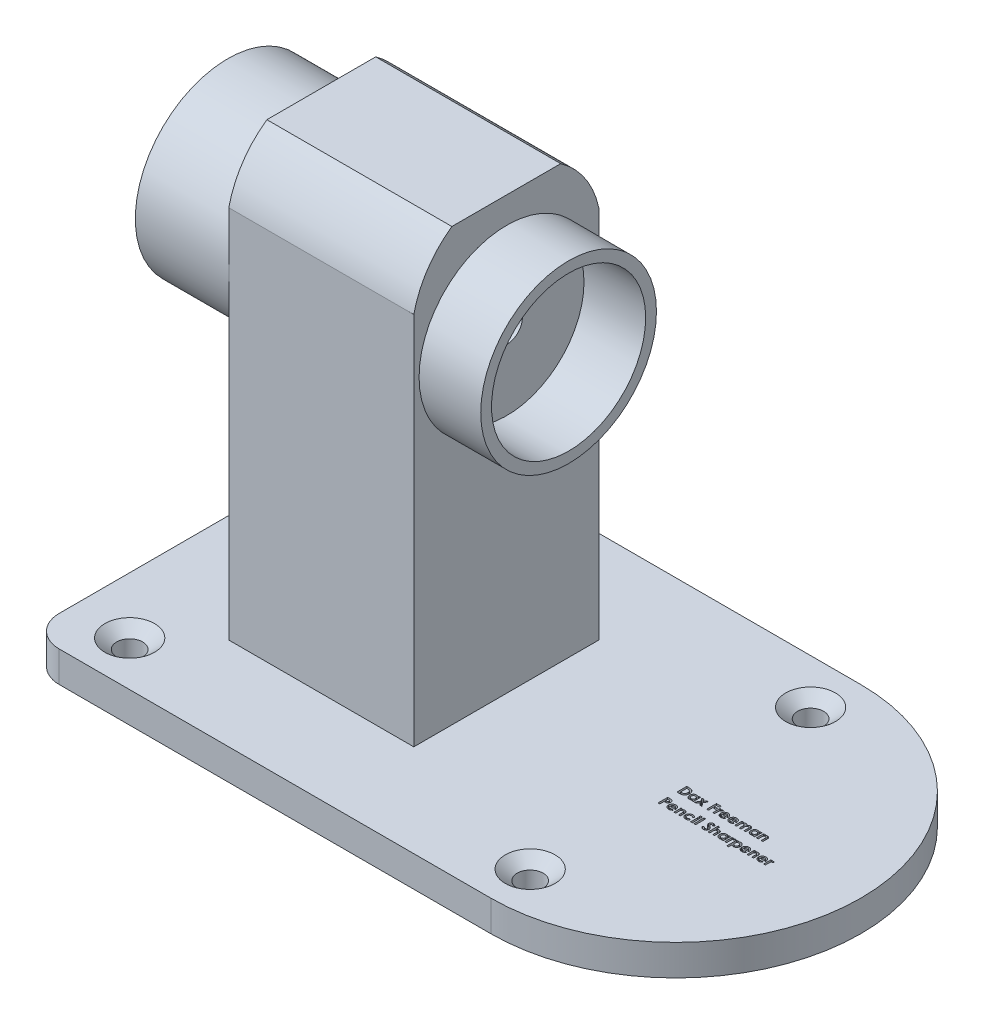
from build123d import *

# Parameters (mm, degrees)
BOSS_EXTRUDE1_DEPTH                                 = 10
SKETCH3_W                                           = 60
SKETCH3_H                                           = 60
BOSS_EXTRUDE3_DEPTH                                 = 150
CUT_EXTRUDE1_DEPTH                                  = 310
SKETCH5_R                                           = 30
BOSS_EXTRUDE5_DEPTH                                 = 38
CUT_EXTRUDE2_DEPTH                                  = 113
CUT_EXTRUDE2_DEPTH_BACK                             = 81
SKETCH6_R                                           = 5
SKETCH7_R                                           = 28.5
SKETCH7_R_2                                         = 25
BOSS_EXTRUDE6_DEPTH                                 = 20
CHAMFER1_SIZE                                       = 16
CHAMFER1_SIZE2                                      = 7.46092253
FILLET1_R                                           = 10
SKETCH9_W                                           = 0.569871795
SKETCH9_H                                           = 2.320192308
SKETCH9_W_2                                         = 0.569871794
SKETCH9_H_2                                         = 3.256410256
CUT_EXTRUDE3_DEPTH                                  = 5
CSK_FOR_5_16_FLAT_HEAD_MACHINE_SCREW_10_D           = 8.4328
CSK_FOR_5_16_FLAT_HEAD_MACHINE_SCREW_10_CSINK_D     = 16.129
CSK_FOR_5_16_FLAT_HEAD_MACHINE_SCREW_10_CSINK_ANGLE = 100


with BuildPart() as part:
    # Sketch1 → Boss-Extrude1 (new body)
    with BuildSketch(Plane(origin=(0, 0, 0), x_dir=(1, 0, 0), z_dir=(0, 1, 0))):
        with BuildLine():
            Line((0, 0), (0, 120))
            Line((0, 120), (150, 120))
            ThreePointArc((150, 120), (210, 60), (150, 0))
            Line((150, 0), (0, 0))
        make_face()
    extrude(amount=BOSS_EXTRUDE1_DEPTH)

    # Sketch3 → Boss-Extrude3 (add)
    with BuildSketch(Plane(origin=(0, 0, 0), x_dir=(1, 0, 0), z_dir=(0, 1, 0))):
        with Locations((65, 60)):
            Rectangle(SKETCH3_W, SKETCH3_H)
    extrude(amount=BOSS_EXTRUDE3_DEPTH)

    # Sketch4 → Cut-Extrude1 (cut)
    with BuildSketch(Plane(origin=(0, 0, 0), x_dir=(0, 0, -1), z_dir=(1, 0, 0))):
        with BuildLine():
            Line((30, 150), (30, 131.448975061))
            ThreePointArc((30, 131.448975061), (34.433573069, 141.884232349), (42.350989331, 150))
            Line((42.350989331, 150), (30, 150))
        make_face()
        with BuildLine():
            ThreePointArc((77.649010669, 150), (85.566426931, 141.884232349), (90, 131.448975061))
            Line((90, 131.448975061), (90, 150))
            Line((90, 150), (77.649010669, 150))
        make_face()
    extrude(amount=CUT_EXTRUDE1_DEPTH, mode=Mode.SUBTRACT)

    # Sketch5 → Boss-Extrude5 (add)
    with BuildSketch(Plane(origin=(35, 0, 0), x_dir=(0, 0, -1), z_dir=(1, 0, 0))):
        with Locations((60.213835263, 112.955759185)):
            Circle(SKETCH5_R)
    extrude(amount=-BOSS_EXTRUDE5_DEPTH)

    # Sketch6 → Cut-Extrude2 (cut, two sides: drawn at the far end of the back side and taken through both)
    with BuildSketch(Plane(origin=(35, 0, 0), x_dir=(0, 0, -1), z_dir=(1, 0, 0)).offset(-CUT_EXTRUDE2_DEPTH_BACK)):
        with Locations(Location((60.213835263, 112.955759185, 0), (0, 0, 180))):
            Circle(SKETCH6_R)
    extrude(amount=CUT_EXTRUDE2_DEPTH + CUT_EXTRUDE2_DEPTH_BACK, mode=Mode.SUBTRACT)

    # Sketch7 → Boss-Extrude6 (add)
    with BuildSketch(Plane(origin=(95, 0, 0), x_dir=(0, 0, -1), z_dir=(1, 0, 0))):
        with Locations(Location((60.213835263, 112.955759185, 0), (0, 0, 180))):
            Circle(SKETCH7_R)
        with Locations((60.213835263, 112.955759185)):
            Circle(SKETCH7_R_2, mode=Mode.SUBTRACT)
    extrude(amount=BOSS_EXTRUDE6_DEPTH)

    # Chamfer1
    chamfer1_edges = [part.edges().sort_by_distance(p)[0] for p in [
        (-3, 112.955759185, -30.213835263),
    ]]
    chamfer1_side = [part.faces().sort_by_distance(p)[0] for p in [
        (-3, 112.955759185, -31.0623634),
    ]]
    chamfer(chamfer1_edges, length=CHAMFER1_SIZE, length2=CHAMFER1_SIZE2, reference=chamfer1_side[0])

    # Fillet1
    fillet1_edges = [part.edges().sort_by_distance(p)[0] for p in [
        (0, 5, 0),
        (0, 5, -120),
    ]]
    fillet(fillet1_edges, radius=FILLET1_R)

    # Sketch9 → Cut-Extrude3 (cut)
    # profile 1 of 26: a face of its own
    with BuildSketch(Plane(origin=(0, 10, 0), x_dir=(1, 0, 0), z_dir=(0, 1, 0))):
        with BuildLine():
            Line((150.366346154, 63.175), (151.084410056, 63.175))
            add(Edge.make_bspline(
                [(151.084410056, 63.175), (151.140391396, 63.174608671), (151.24860396, 63.173852228), (151.405382557, 63.165328937), (151.551166702, 63.152220719), (151.68605037, 63.13418799), (151.809757028, 63.110325751), (151.922127158, 63.080395249), (152.023537902, 63.045845465), (152.115101207, 63.005190632), (152.198689698, 62.957791134), (152.278059638, 62.9049919), (152.353055186, 62.844858738), (152.424728785, 62.778551736), (152.492155474, 62.70485783), (152.556458147, 62.624997656), (152.616062384, 62.537813133), (152.672769891, 62.44539467), (152.724054286, 62.347350606), (152.768786451, 62.244515472), (152.806258858, 62.137551051), (152.836707128, 62.026343346), (152.860977914, 61.911261533), (152.877959693, 61.792073387), (152.888457999, 61.668889258), (152.889522964, 61.585401325), (152.890064103, 61.542978766)],
                knots=[0, 0, 0, 0, 1.44355588, 2.790409838, 4.047694926, 5.217575253, 6.298404546, 7.294384826, 8.214239204, 9.058592145, 9.873746385, 10.689560431, 11.514393297, 12.350027578, 13.205127629, 14.088021785, 14.991911688, 15.926770944, 16.882954281, 17.842803888, 18.816321264, 19.80318086, 20.814351908, 21.847355356, 22.906180909, 24, 24, 24, 24], degree=3))
            add(Edge.make_bspline(
                [(152.890064103, 61.542978766), (152.888647109, 61.483117774), (152.885857675, 61.365277906), (152.862361039, 61.192349258), (152.824359022, 61.026579902), (152.770924736, 60.869266549), (152.704680524, 60.721810098), (152.625544395, 60.586810881), (152.53467667, 60.464993507), (152.433135961, 60.356964526), (152.323192104, 60.264112152), (152.208938266, 60.184590889), (152.089261406, 60.121881737), (151.983809368, 60.082114758), (151.892369295, 60.057383137), (151.8120859, 60.042766511), (151.720892154, 60.029362183), (151.617937757, 60.019003607), (151.503674345, 60.009766303), (151.377646464, 60.004747111), (151.240262156, 60.000576908), (151.144835764, 60.000197342), (151.095222356, 60)],
                knots=[0, 0, 0, 0, 1.315458931, 2.589557908, 3.828601765, 5.048913369, 6.235739168, 7.376350998, 8.481830359, 9.569842114, 10.627874879, 11.640079404, 12.624025415, 13.590060155, 14.111227486, 14.704434459, 15.382649715, 16.137166398, 16.978595427, 17.902333227, 18.909396075, 20, 20, 20, 20], degree=3))
            Line((151.095222356, 60), (150.366346154, 60))
            Line((150.366346154, 60), (150.366346154, 63.175))
        make_face()
        with BuildLine():
            Line((150.936217949, 62.605128205), (150.936217949, 60.569871795))
            Line((150.936217949, 60.569871795), (151.233874199, 60.569871795))
            add(Edge.make_bspline(
                [(151.233874199, 60.569871795), (151.269290721, 60.569936693), (151.337408484, 60.570061513), (151.435755115, 60.576006794), (151.526700811, 60.581974217), (151.609995222, 60.593300586), (151.686244537, 60.605917364), (151.754401291, 60.623475338), (151.815870491, 60.641918503), (151.869901302, 60.665398937), (151.919389123, 60.691827729), (151.965209192, 60.722792122), (152.009438388, 60.757176912), (152.051249809, 60.795993406), (152.090801702, 60.8387276), (152.127860053, 60.885599685), (152.162919493, 60.936466651), (152.195080112, 60.991597446), (152.224468658, 61.050409875), (152.250539591, 61.112334256), (152.272156242, 61.177886283), (152.290122679, 61.246452313), (152.302961735, 61.318629289), (152.313583605, 61.393882606), (152.319059489, 61.472510413), (152.31981102, 61.526011401), (152.320192308, 61.553155048)],
                knots=[0, 0, 0, 0, 1.50275155, 2.890291501, 4.180787663, 5.369391935, 6.45668281, 7.458360028, 8.354766181, 9.177074746, 9.954075863, 10.732690366, 11.5210699, 12.329727389, 13.151100085, 13.990027547, 14.863562427, 15.770965086, 16.696477834, 17.652329173, 18.619756807, 19.62365428, 20.657822005, 21.729286259, 22.847956731, 24, 24, 24, 24], degree=3))
            add(Edge.make_bspline(
                [(152.320192308, 61.553155048), (152.319432911, 61.594750121), (152.317952147, 61.675857292), (152.303671978, 61.793991655), (152.280426586, 61.905232856), (152.247257651, 62.009168048), (152.205447182, 62.106089343), (152.153111632, 62.195175613), (152.092503324, 62.277923385), (152.044575927, 62.326465883), (152.020628005, 62.350721154)],
                knots=[0, 0, 0, 0, 1.13821349, 2.219428113, 3.251817212, 4.244760574, 5.201143372, 6.134805572, 7.068016741, 8, 8, 8, 8], degree=3))
            add(Edge.make_bspline(
                [(152.020628005, 62.350721154), (151.997013086, 62.371389923), (151.948782288, 62.413603545), (151.864104856, 62.464186259), (151.770794711, 62.508628131), (151.666717198, 62.543865579), (151.552878179, 62.571732856), (151.428599626, 62.590952235), (151.294547078, 62.603302404), (151.201678597, 62.604506566), (151.153735978, 62.605128205)],
                knots=[0, 0, 0, 0, 0.813307809, 1.661089106, 2.549956539, 3.493439533, 4.508053171, 5.589449661, 6.755572447, 8, 8, 8, 8], degree=3))
            Line((151.153735978, 62.605128205), (150.936217949, 62.605128205))
        make_face(mode=Mode.SUBTRACT)
    # profile 2 of 26: a face of its own
    with BuildSketch(Plane(origin=(0, 10, 0), x_dir=(1, 0, 0), z_dir=(0, 1, 0))):
        with BuildLine():
            Line((155.128846154, 62.320192308), (155.698717949, 62.320192308))
            Line((155.698717949, 62.320192308), (155.698717949, 60))
            Line((155.698717949, 60), (155.128846154, 60))
            Line((155.128846154, 60), (155.128846154, 60.253135016))
            add(Edge.make_bspline(
                [(155.128846154, 60.253135016), (155.100609216, 60.228495124), (155.045806897, 60.180673959), (154.959456175, 60.118624782), (154.872853125, 60.06744223), (154.785581619, 60.026678118), (154.69630033, 59.996578018), (154.604366468, 59.974784842), (154.508456088, 59.961932873), (154.443257533, 59.960183365), (154.410146234, 59.959294872)],
                knots=[0, 0, 0, 0, 1.129196829, 2.191548051, 3.199897424, 4.157751732, 5.089409408, 6.034969131, 7.002052659, 8, 8, 8, 8], degree=3))
            add(Edge.make_bspline(
                [(154.410146234, 59.959294872), (154.372977329, 59.960131056), (154.299529466, 59.961783403), (154.191752881, 59.979177023), (154.087683874, 60.005801836), (153.987406919, 60.043479273), (153.891104461, 60.092301846), (153.798039495, 60.150995704), (153.709807437, 60.221621354), (153.625673786, 60.301123004), (153.54864152, 60.388575384), (153.481299185, 60.482764668), (153.424534602, 60.582354988), (153.378030417, 60.687016157), (153.34144887, 60.796671359), (153.315371461, 60.911668388), (153.29998576, 61.032048314), (153.298081444, 61.114046405), (153.297115385, 61.15564403)],
                knots=[0, 0, 0, 0, 0.980476535, 1.937477201, 2.874147792, 3.812856188, 4.758993464, 5.720109578, 6.712210464, 7.737600662, 8.772720504, 9.783789959, 10.789002326, 11.793715968, 12.802552247, 13.835794126, 14.902098527, 16, 16, 16, 16], degree=3))
            add(Edge.make_bspline(
                [(153.297115385, 61.15564403), (153.298129268, 61.198718426), (153.300118112, 61.283213653), (153.314666391, 61.407206381), (153.340262574, 61.525054751), (153.375164808, 61.636922001), (153.420060472, 61.742827458), (153.474740391, 61.842944627), (153.539948434, 61.937011819), (153.615089144, 62.023427944), (153.696222656, 62.102632497), (153.78302117, 62.171586342), (153.874127347, 62.230165841), (153.969638005, 62.277989445), (154.069539504, 62.314945106), (154.173437433, 62.341962712), (154.281793027, 62.358174224), (154.355605735, 62.35998216), (154.392973758, 62.360897436)],
                knots=[0, 0, 0, 0, 1.136281865, 2.228943489, 3.287578264, 4.313574083, 5.316051562, 6.317280042, 7.318008486, 8.329309503, 9.333984563, 10.305318864, 11.248632312, 12.186624717, 13.117503092, 14.05354244, 15.014596925, 16, 16, 16, 16], degree=3))
            add(Edge.make_bspline(
                [(154.392973758, 62.360897436), (154.427588655, 62.360178304), (154.496079059, 62.358755402), (154.596750085, 62.343305404), (154.69438646, 62.319938379), (154.788455574, 62.286644575), (154.879729011, 62.244604374), (154.966636813, 62.191924869), (155.051080164, 62.130820156), (155.102603886, 62.08309608), (155.128846154, 62.058789062)],
                knots=[0, 0, 0, 0, 1.017011718, 2.012299608, 2.98747302, 3.965332399, 4.941441765, 5.936729654, 6.94912688, 8, 8, 8, 8], degree=3))
            Line((155.128846154, 62.058789062), (155.128846154, 62.320192308))
        make_face()
        with BuildLine():
            add(Edge.make_bspline(
                [(154.512545072, 61.831730769), (154.489837361, 61.831034018), (154.44533173, 61.829668432), (154.379880109, 61.821454334), (154.317327993, 61.806980729), (154.258121501, 61.785599085), (154.201378237, 61.759553127), (154.147959857, 61.726930993), (154.097425482, 61.688372324), (154.050072312, 61.644810625), (154.00690292, 61.596928353), (153.969688384, 61.54467842), (153.938062041, 61.489468665), (153.911314375, 61.43113309), (153.892169114, 61.368981407), (153.877006076, 61.303822718), (153.86913744, 61.235124712), (153.867711105, 61.188309147), (153.866987179, 61.164548277)],
                knots=[0, 0, 0, 0, 1.04836806, 2.054732945, 3.03993516, 4.00574415, 4.955904794, 5.917688631, 6.888591924, 7.88601754, 8.884115178, 9.859153345, 10.841239365, 11.818093293, 12.814750328, 13.83810466, 14.90274714, 16, 16, 16, 16], degree=3))
            add(Edge.make_bspline(
                [(153.866987179, 61.164548277), (153.867700047, 61.140571883), (153.869104743, 61.093326676), (153.877133304, 61.024049178), (153.891750714, 60.957938674), (153.913076963, 60.895529623), (153.939121261, 60.835979922), (153.970823029, 60.779564396), (154.009763097, 60.727280544), (154.052970332, 60.677891154), (154.101294945, 60.633788346), (154.152115264, 60.594629101), (154.206125452, 60.561864586), (154.262739538, 60.535384097), (154.321766957, 60.513804725), (154.383947733, 60.499513023), (154.448672726, 60.490376608), (154.492797464, 60.489104303), (154.515089143, 60.488461538)],
                knots=[0, 0, 0, 0, 1.099136573, 2.165835871, 3.191374663, 4.196217796, 5.183857741, 6.167377911, 7.154730987, 8.166690795, 9.170734848, 10.148332609, 11.103258353, 12.059567475, 13.009337315, 13.978056681, 14.978520572, 16, 16, 16, 16], degree=3))
            add(Edge.make_bspline(
                [(154.515089143, 60.488461538), (154.538219811, 60.489162196), (154.583568497, 60.490535864), (154.650087928, 60.498674999), (154.713480342, 60.513201674), (154.773481994, 60.534705733), (154.83100935, 60.560564732), (154.885543278, 60.592549405), (154.936492003, 60.631019592), (154.984113557, 60.67497509), (155.027749531, 60.723248349), (155.065478714, 60.776183457), (155.098342212, 60.832087404), (155.124187842, 60.892281961), (155.144712897, 60.955714007), (155.15943915, 61.022777213), (155.167449378, 61.093543882), (155.168841789, 61.141844891), (155.169551282, 61.16645633)],
                knots=[0, 0, 0, 0, 1.050008698, 2.058587853, 3.036635738, 3.995319155, 4.947022481, 5.895997462, 6.858296291, 7.838991643, 8.833936038, 9.806048392, 10.784806122, 11.771666913, 12.772873988, 13.80724452, 14.882696879, 16, 16, 16, 16], degree=3))
            add(Edge.make_bspline(
                [(155.169551282, 61.16645633), (155.168850605, 61.190644464), (155.167481979, 61.237890916), (155.159404604, 61.307180011), (155.144573803, 61.372926402), (155.124471188, 61.43525094), (155.098165756, 61.494011121), (155.065277392, 61.548555434), (155.027962076, 61.600773636), (154.983842989, 61.647742768), (154.936479412, 61.691379994), (154.884781404, 61.728686815), (154.830377731, 61.760838869), (154.772934138, 61.787236944), (154.711918722, 61.806587735), (154.648417975, 61.821570343), (154.581441151, 61.829663502), (154.5358852, 61.831030435), (154.512545072, 61.831730769)],
                knots=[0, 0, 0, 0, 1.106611376, 2.161533483, 3.185006901, 4.184773755, 5.152708835, 6.122342771, 7.094156588, 8.082475533, 9.064254463, 10.03606828, 10.992420271, 11.951521816, 12.920622147, 13.915721683, 14.932141191, 16, 16, 16, 16], degree=3))
        make_face(mode=Mode.SUBTRACT)
    # profile 3 of 26: a face of its own
    with BuildSketch(Plane(origin=(0, 10, 0), x_dir=(1, 0, 0), z_dir=(0, 1, 0))):
        Polygon((156.100045072, 62.320192308), (156.743058894, 62.320192308), (157.201627604, 61.687990785), (157.658288261, 62.320192308), (158.301302083, 62.320192308), (157.524088542, 61.243414463), (158.425961538, 60), (157.782947716, 60), (157.203535657, 60.798838141), (156.626667668, 60), (155.983653846, 60), (156.88107472, 61.243414463), align=None)
    # profile 4 of 26: a face of its own
    with BuildSketch(Plane(origin=(0, 10, 0), x_dir=(1, 0, 0), z_dir=(0, 1, 0))):
        Polygon((160.013461538, 63.175), (161.56025641, 63.175), (161.56025641, 62.605128205), (160.583333333, 62.605128205), (160.583333333, 61.994551282), (161.56025641, 61.994551282), (161.56025641, 61.424679487), (160.583333333, 61.424679487), (160.583333333, 60), (160.013461538, 60), align=None)
    # profile 5 of 26: a face of its own
    with BuildSketch(Plane(origin=(0, 10, 0), x_dir=(1, 0, 0), z_dir=(0, 1, 0))):
        with BuildLine():
            Line((161.967307692, 62.320192308), (162.455769231, 62.320192308))
            Line((162.455769231, 62.320192308), (162.455769231, 62.034620393))
            add(Edge.make_bspline(
                [(162.455769231, 62.034620393), (162.46958687, 62.059999247), (162.496594019, 62.109603272), (162.546208417, 62.176186851), (162.603207447, 62.232261684), (162.665542957, 62.279000626), (162.733403875, 62.315429043), (162.804973005, 62.341388882), (162.879638075, 62.35825918), (162.930572055, 62.360011685), (162.956315104, 62.360897436)],
                knots=[0, 0, 0, 0, 1.09866127, 2.147379032, 3.14564304, 4.131443017, 5.102343063, 6.064490016, 7.021754664, 8, 8, 8, 8], degree=3))
            add(Edge.make_bspline(
                [(162.956315104, 62.360897436), (162.97500777, 62.360022129), (163.013072712, 62.358239691), (163.07108904, 62.347878355), (163.129942443, 62.329143087), (163.168673053, 62.312274469), (163.188461538, 62.303655849)],
                knots=[0, 0, 0, 0, 0.931404136, 1.896671404, 2.925354185, 4, 4, 4, 4], degree=3))
            Line((163.188461538, 62.303655849), (163.011648638, 61.82091847))
            add(Edge.make_bspline(
                [(163.011648638, 61.82091847), (162.995844089, 61.828554463), (162.966137622, 61.842907192), (162.92300899, 61.85984489), (162.883867968, 61.870179446), (162.859053279, 61.871721452), (162.84755609, 61.872435897)],
                knots=[0, 0, 0, 0, 1.214386998, 2.282580073, 3.20428172, 4, 4, 4, 4], degree=3))
            add(Edge.make_bspline(
                [(162.84755609, 61.872435897), (162.836700507, 61.871962468), (162.815345706, 61.871031151), (162.783826617, 61.863050083), (162.754142198, 61.849286977), (162.72486196, 61.831655073), (162.698295788, 61.807145407), (162.671746026, 61.778771118), (162.648348953, 61.743739283), (162.623658256, 61.704747072), (162.602635011, 61.657020641), (162.584608225, 61.600045117), (162.568546214, 61.533161255), (162.557493358, 61.456013934), (162.546810329, 61.369349687), (162.540451527, 61.272532411), (162.535712232, 61.165868249), (162.535422456, 61.091412815), (162.535271434, 61.052609175)],
                knots=[0, 0, 0, 0, 0.544232178, 1.070598461, 1.618251235, 2.182094276, 2.777567932, 3.425210017, 4.127676488, 4.886675562, 5.738955394, 6.734782583, 7.883056018, 9.186093582, 10.642914445, 12.264202625, 14.053029461, 16, 16, 16, 16], degree=3))
            Line((162.535271434, 61.052609175), (162.537179487, 60.939398037))
            Line((162.537179487, 60.939398037), (162.537179487, 60))
            Line((162.537179487, 60), (161.967307692, 60))
            Line((161.967307692, 60), (161.967307692, 62.320192308))
        make_face()
    # profile 6 of 26: a face of its own
    with BuildSketch(Plane(origin=(0, 10, 0), x_dir=(1, 0, 0), z_dir=(0, 1, 0))):
        with BuildLine():
            Line((165.791681691, 61.017628205), (163.961858974, 61.017628205))
            add(Edge.make_bspline(
                [(163.961858974, 61.017628205), (163.965589835, 60.996366703), (163.972921271, 60.954586175), (163.988841744, 60.893896331), (164.009158656, 60.836703248), (164.033507195, 60.78293047), (164.061476846, 60.732293723), (164.094101126, 60.685030513), (164.130966227, 60.641182585), (164.171859003, 60.600940508), (164.216097848, 60.564882735), (164.263468218, 60.533293846), (164.314018997, 60.50739289), (164.36717064, 60.485561071), (164.423320311, 60.468268059), (164.482550648, 60.456341398), (164.544704642, 60.449296275), (164.587045841, 60.448277279), (164.608688902, 60.44775641)],
                knots=[0, 0, 0, 0, 1.091296461, 2.144483647, 3.168565212, 4.157007626, 5.126487748, 6.090021542, 7.05641414, 8.019231907, 8.98705074, 9.938580405, 10.892824166, 11.854447369, 12.841318655, 13.858982407, 14.905600794, 16, 16, 16, 16], degree=3))
            add(Edge.make_bspline(
                [(164.608688902, 60.44775641), (164.634813546, 60.448446126), (164.686260664, 60.44980438), (164.761631075, 60.461850072), (164.834525241, 60.48004456), (164.904253327, 60.507101292), (164.971623023, 60.540782167), (165.035525217, 60.582744392), (165.097066006, 60.631761696), (165.13461314, 60.669544214), (165.15375601, 60.688807091)],
                knots=[0, 0, 0, 0, 1.021034703, 2.010718019, 2.977989445, 3.954245119, 4.929443971, 5.918328161, 6.938689359, 8, 8, 8, 8], degree=3))
            Line((165.15375601, 60.688807091), (165.630769231, 60.461748798))
            add(Edge.make_bspline(
                [(165.630769231, 60.461748798), (165.615750748, 60.44099556), (165.585992176, 60.399873781), (165.537412307, 60.342004818), (165.48671612, 60.288010728), (165.433865806, 60.238246638), (165.378794338, 60.192854357), (165.321654911, 60.151280923), (165.261612457, 60.114642568), (165.199867512, 60.08116675), (165.135143694, 60.052468086), (165.067620124, 60.027994878), (164.997582801, 60.005871307), (164.924147306, 59.989014358), (164.847925134, 59.975670534), (164.768733948, 59.966194651), (164.686584184, 59.960341853), (164.630747468, 59.959648011), (164.602328726, 59.959294872)],
                knots=[0, 0, 0, 0, 1.028154879, 2.037251081, 3.030720504, 4.000128189, 4.949298328, 5.894184978, 6.834267904, 7.770992897, 8.712077017, 9.673380525, 10.653304757, 11.658697181, 12.695551717, 13.758623199, 14.859225354, 16, 16, 16, 16], degree=3))
            add(Edge.make_bspline(
                [(164.602328726, 59.959294872), (164.558606958, 59.960186227), (164.472980394, 59.961931895), (164.347736067, 59.978134193), (164.228788693, 60.004999348), (164.115802408, 60.041518401), (164.009265613, 60.089734992), (163.909125583, 60.148707882), (163.814381775, 60.217306444), (163.727929143, 60.296970377), (163.649168245, 60.383679833), (163.579989569, 60.476799867), (163.522101837, 60.575679886), (163.474563269, 60.67966548), (163.437614641, 60.789022811), (163.410976824, 60.903799602), (163.394647523, 61.023941033), (163.392883877, 61.105770758), (163.391987179, 61.147375801)],
                knots=[0, 0, 0, 0, 1.103565453, 2.161269334, 3.182010356, 4.179077853, 5.15417608, 6.128274628, 7.109042802, 8.101804412, 9.090965879, 10.063106201, 11.02526161, 11.978650795, 12.945248442, 13.93468508, 14.949922959, 16, 16, 16, 16], degree=3))
            add(Edge.make_bspline(
                [(163.391987179, 61.147375801), (163.392892703, 61.190038082), (163.394674279, 61.273974203), (163.410836229, 61.396889754), (163.437688286, 61.514167815), (163.474744996, 61.62596989), (163.521562399, 61.732645647), (163.580186652, 61.833261803), (163.649133915, 61.928168647), (163.727611079, 62.016922196), (163.814429951, 62.09703197), (163.906683205, 62.168425789), (164.005407401, 62.227915857), (164.109485883, 62.275983795), (164.218252928, 62.315037782), (164.33296573, 62.341024948), (164.4527515, 62.358473775), (164.534634415, 62.360080703), (164.576252003, 62.360897436)],
                knots=[0, 0, 0, 0, 1.079208495, 2.12329425, 3.130605359, 4.119693003, 5.099659317, 6.073216462, 7.060498243, 8.06384408, 9.066070512, 10.045757761, 11.010926815, 11.975797609, 12.942977511, 13.929384301, 14.947594487, 16, 16, 16, 16], degree=3))
            add(Edge.make_bspline(
                [(164.576252003, 62.360897436), (164.620183228, 62.359992252), (164.706437662, 62.358215016), (164.832554278, 62.342144278), (164.952291448, 62.315115301), (165.066159319, 62.278912022), (165.172703752, 62.229477429), (165.274265851, 62.171955769), (165.368409581, 62.101874397), (165.456138414, 62.022600313), (165.535331615, 61.934648465), (165.604555248, 61.839105819), (165.663456039, 61.736904817), (165.711195715, 61.627631011), (165.748106403, 61.511612453), (165.774768878, 61.388999814), (165.790973625, 61.259326736), (165.792704454, 61.170532148), (165.793589744, 61.125115184)],
                knots=[0, 0, 0, 0, 1.080001299, 2.120471247, 3.119684163, 4.095710327, 5.052285597, 6.002875087, 6.961153713, 7.931888285, 8.906493152, 9.865905668, 10.82813294, 11.801621613, 12.7925306, 13.817193356, 14.883530496, 16, 16, 16, 16], degree=3))
            Line((165.793589744, 61.125115184), (165.791681691, 61.017628205))
        make_face()
        with BuildLine():
            add(Edge.make_bspline(
                [(165.223717949, 61.465384615), (165.212964119, 61.494404845), (165.191582705, 61.55210462), (165.143282981, 61.631716231), (165.079190792, 61.700663119), (165.004646978, 61.761702347), (164.919476003, 61.811245596), (164.826361754, 61.847116518), (164.726481176, 61.868625172), (164.657768721, 61.87114776), (164.62268129, 61.872435897)],
                knots=[0, 0, 0, 0, 0.954238005, 1.897273737, 2.851915805, 3.847685534, 4.862635127, 5.880135777, 6.917509367, 8, 8, 8, 8], degree=3))
            add(Edge.make_bspline(
                [(164.62268129, 61.872435897), (164.584360103, 61.871198484), (164.509450161, 61.868779599), (164.401397671, 61.843053869), (164.29947446, 61.804658984), (164.239386312, 61.765073043), (164.209269832, 61.745232372)],
                knots=[0, 0, 0, 0, 1.044195649, 2.041185066, 3.018232172, 4, 4, 4, 4], degree=3))
            add(Edge.make_bspline(
                [(164.209269832, 61.745232372), (164.190479397, 61.730121282), (164.150419152, 61.697905211), (164.098392796, 61.633637207), (164.047146403, 61.555823082), (164.018010003, 61.496717757), (164.002564103, 61.465384615)],
                knots=[0, 0, 0, 0, 0.82159062, 1.751589201, 2.808063854, 4, 4, 4, 4], degree=3))
            Line((164.002564103, 61.465384615), (165.223717949, 61.465384615))
        make_face(mode=Mode.SUBTRACT)
    # profile 7 of 26: a face of its own
    with BuildSketch(Plane(origin=(0, 10, 0), x_dir=(1, 0, 0), z_dir=(0, 1, 0))):
        with BuildLine():
            Line((168.600335537, 61.017628205), (166.770512821, 61.017628205))
            add(Edge.make_bspline(
                [(166.770512821, 61.017628205), (166.774243681, 60.996366703), (166.781575117, 60.954586175), (166.79749559, 60.893896331), (166.817812502, 60.836703248), (166.842161041, 60.78293047), (166.870130692, 60.732293723), (166.902754972, 60.685030513), (166.939620073, 60.641182585), (166.980512849, 60.600940508), (167.024751694, 60.564882735), (167.072122064, 60.533293846), (167.122672843, 60.50739289), (167.175824486, 60.485561071), (167.231974157, 60.468268059), (167.291204494, 60.456341398), (167.353358488, 60.449296275), (167.395699687, 60.448277279), (167.417342748, 60.44775641)],
                knots=[0, 0, 0, 0, 1.091296461, 2.144483647, 3.168565212, 4.157007626, 5.126487748, 6.090021542, 7.05641414, 8.019231907, 8.98705074, 9.938580405, 10.892824166, 11.854447369, 12.841318655, 13.858982407, 14.905600794, 16, 16, 16, 16], degree=3))
            add(Edge.make_bspline(
                [(167.417342748, 60.44775641), (167.443467392, 60.448446126), (167.49491451, 60.44980438), (167.570284921, 60.461850072), (167.643179087, 60.48004456), (167.712907173, 60.507101292), (167.780276869, 60.540782167), (167.844179063, 60.582744392), (167.905719852, 60.631761696), (167.943266986, 60.669544214), (167.962409856, 60.688807091)],
                knots=[0, 0, 0, 0, 1.021034703, 2.010718019, 2.977989445, 3.954245119, 4.929443971, 5.918328161, 6.938689359, 8, 8, 8, 8], degree=3))
            Line((167.962409856, 60.688807091), (168.439423077, 60.461748798))
            add(Edge.make_bspline(
                [(168.439423077, 60.461748798), (168.424404594, 60.44099556), (168.394646023, 60.399873781), (168.346066153, 60.342004818), (168.295369966, 60.288010728), (168.242519652, 60.238246638), (168.187448184, 60.192854357), (168.130308758, 60.151280923), (168.070266303, 60.114642568), (168.008521358, 60.08116675), (167.94379754, 60.052468086), (167.87627397, 60.027994878), (167.806236647, 60.005871307), (167.732801152, 59.989014358), (167.65657898, 59.975670534), (167.577387794, 59.966194651), (167.49523803, 59.960341853), (167.439401314, 59.959648011), (167.410982572, 59.959294872)],
                knots=[0, 0, 0, 0, 1.028154879, 2.037251081, 3.030720504, 4.000128189, 4.949298328, 5.894184978, 6.834267904, 7.770992897, 8.712077017, 9.673380525, 10.653304757, 11.658697181, 12.695551717, 13.758623199, 14.859225354, 16, 16, 16, 16], degree=3))
            add(Edge.make_bspline(
                [(167.410982572, 59.959294872), (167.367260804, 59.960186227), (167.28163424, 59.961931895), (167.156389913, 59.978134193), (167.037442539, 60.004999348), (166.924456254, 60.041518401), (166.817919459, 60.089734992), (166.717779429, 60.148707882), (166.623035622, 60.217306444), (166.536582989, 60.296970377), (166.457822091, 60.383679833), (166.388643415, 60.476799867), (166.330755684, 60.575679886), (166.283217115, 60.67966548), (166.246268487, 60.789022811), (166.21963067, 60.903799602), (166.203301369, 61.023941033), (166.201537724, 61.105770758), (166.200641026, 61.147375801)],
                knots=[0, 0, 0, 0, 1.103565453, 2.161269334, 3.182010356, 4.179077853, 5.15417608, 6.128274628, 7.109042802, 8.101804412, 9.090965879, 10.063106201, 11.02526161, 11.978650795, 12.945248442, 13.93468508, 14.949922959, 16, 16, 16, 16], degree=3))
            add(Edge.make_bspline(
                [(166.200641026, 61.147375801), (166.201546549, 61.190038082), (166.203328126, 61.273974203), (166.219490075, 61.396889754), (166.246342132, 61.514167815), (166.283398842, 61.62596989), (166.330216245, 61.732645647), (166.388840498, 61.833261803), (166.457787761, 61.928168647), (166.536264925, 62.016922196), (166.623083797, 62.09703197), (166.715337051, 62.168425789), (166.814061247, 62.227915857), (166.918139729, 62.275983795), (167.026906774, 62.315037782), (167.141619576, 62.341024948), (167.261405347, 62.358473775), (167.343288261, 62.360080703), (167.384905849, 62.360897436)],
                knots=[0, 0, 0, 0, 1.079208495, 2.12329425, 3.130605359, 4.119693003, 5.099659317, 6.073216462, 7.060498243, 8.06384408, 9.066070512, 10.045757761, 11.010926815, 11.975797609, 12.942977511, 13.929384301, 14.947594487, 16, 16, 16, 16], degree=3))
            add(Edge.make_bspline(
                [(167.384905849, 62.360897436), (167.428837075, 62.359992252), (167.515091508, 62.358215016), (167.641208124, 62.342144278), (167.760945294, 62.315115301), (167.874813165, 62.278912022), (167.981357598, 62.229477429), (168.082919697, 62.171955769), (168.177063427, 62.101874397), (168.26479226, 62.022600313), (168.343985461, 61.934648465), (168.413209094, 61.839105819), (168.472109885, 61.736904817), (168.519849561, 61.627631011), (168.556760249, 61.511612453), (168.583422724, 61.388999814), (168.599627472, 61.259326736), (168.6013583, 61.170532148), (168.60224359, 61.125115184)],
                knots=[0, 0, 0, 0, 1.080001299, 2.120471247, 3.119684163, 4.095710327, 5.052285597, 6.002875087, 6.961153713, 7.931888285, 8.906493152, 9.865905668, 10.82813294, 11.801621613, 12.7925306, 13.817193356, 14.883530496, 16, 16, 16, 16], degree=3))
            Line((168.60224359, 61.125115184), (168.600335537, 61.017628205))
        make_face()
        with BuildLine():
            add(Edge.make_bspline(
                [(168.032371795, 61.465384615), (168.021617966, 61.494404845), (168.000236551, 61.55210462), (167.951936827, 61.631716231), (167.887844638, 61.700663119), (167.813300824, 61.761702347), (167.728129849, 61.811245596), (167.6350156, 61.847116518), (167.535135022, 61.868625172), (167.466422567, 61.87114776), (167.431335136, 61.872435897)],
                knots=[0, 0, 0, 0, 0.954238005, 1.897273737, 2.851915805, 3.847685534, 4.862635127, 5.880135777, 6.917509367, 8, 8, 8, 8], degree=3))
            add(Edge.make_bspline(
                [(167.431335136, 61.872435897), (167.393013949, 61.871198484), (167.318104007, 61.868779599), (167.210051517, 61.843053869), (167.108128306, 61.804658984), (167.048040158, 61.765073043), (167.017923678, 61.745232372)],
                knots=[0, 0, 0, 0, 1.044195649, 2.041185066, 3.018232172, 4, 4, 4, 4], degree=3))
            add(Edge.make_bspline(
                [(167.017923678, 61.745232372), (166.999133244, 61.730121282), (166.959072998, 61.697905211), (166.907046642, 61.633637207), (166.855800249, 61.555823082), (166.826663849, 61.496717757), (166.811217949, 61.465384615)],
                knots=[0, 0, 0, 0, 0.82159062, 1.751589201, 2.808063854, 4, 4, 4, 4], degree=3))
            Line((166.811217949, 61.465384615), (168.032371795, 61.465384615))
        make_face(mode=Mode.SUBTRACT)
    # profile 8 of 26: a face of its own
    with BuildSketch(Plane(origin=(0, 10, 0), x_dir=(1, 0, 0), z_dir=(0, 1, 0))):
        with BuildLine():
            Line((169.090705128, 62.320192308), (169.660576923, 62.320192308))
            Line((169.660576923, 62.320192308), (169.660576923, 62.042888622))
            add(Edge.make_bspline(
                [(169.660576923, 62.042888622), (169.685924531, 62.068471642), (169.735831888, 62.118842507), (169.81853814, 62.183598782), (169.904809137, 62.238973398), (169.995690344, 62.283802634), (170.090959471, 62.318032993), (170.190164992, 62.343116496), (170.293816467, 62.357914977), (170.364389112, 62.359892263), (170.400265425, 62.360897436)],
                knots=[0, 0, 0, 0, 1.041528618, 2.050684245, 3.032913108, 4.004406485, 4.976926473, 5.95771665, 6.961784757, 8, 8, 8, 8], degree=3))
            add(Edge.make_bspline(
                [(170.400265425, 62.360897436), (170.436189107, 62.359767476), (170.506903713, 62.357543187), (170.610075831, 62.337188856), (170.707814929, 62.304119945), (170.799045647, 62.256984276), (170.884427347, 62.198774176), (170.960177564, 62.126482326), (171.028361862, 62.042986508), (171.064706718, 61.979862772), (171.083348357, 61.947485978)],
                knots=[0, 0, 0, 0, 1.023965777, 2.015643508, 2.987309376, 3.958410333, 4.93654923, 5.924956801, 6.93568961, 8, 8, 8, 8], degree=3))
            add(Edge.make_bspline(
                [(171.083348357, 61.947485978), (171.107361198, 61.97995085), (171.154491666, 62.043670283), (171.238034713, 62.126863228), (171.328369672, 62.198781714), (171.427244317, 62.257414024), (171.532032879, 62.303959055), (171.642276817, 62.337065986), (171.756976623, 62.357509169), (171.835036135, 62.359758631), (171.874554287, 62.360897436)],
                knots=[0, 0, 0, 0, 1.041189987, 2.043563759, 3.033412161, 4.015238574, 5.00275396, 5.986226558, 6.980513695, 8, 8, 8, 8], degree=3))
            add(Edge.make_bspline(
                [(171.874554287, 62.360897436), (171.915371844, 62.359714962), (171.994860243, 62.357412205), (172.110050348, 62.334757106), (172.21793982, 62.299751579), (172.316144332, 62.24880997), (172.404943974, 62.188467616), (172.480611981, 62.117170607), (172.543409512, 62.0374068), (172.584298758, 61.962926867), (172.610732558, 61.897078077), (172.62669352, 61.839777292), (172.641621959, 61.775793717), (172.652346548, 61.704267325), (172.662357478, 61.625870407), (172.668169217, 61.540081755), (172.672119517, 61.447190371), (172.672539088, 61.382919328), (172.67275641, 61.349629407)],
                knots=[0, 0, 0, 0, 1.321991808, 2.574456155, 3.791773975, 4.987670122, 6.148905103, 7.262530793, 8.344737981, 9.427709016, 10.004683293, 10.642050061, 11.354108788, 12.133887687, 12.985666279, 13.916212488, 14.92067847, 16, 16, 16, 16], degree=3))
            Line((172.67275641, 61.349629407), (172.67275641, 60))
            Line((172.67275641, 60), (172.102884615, 60))
            Line((172.102884615, 60), (172.102884615, 61.165184295))
            add(Edge.make_bspline(
                [(172.102884615, 61.165184295), (172.102410305, 61.196350809), (172.101499909, 61.256172116), (172.097629466, 61.341974361), (172.088965758, 61.419789592), (172.078810782, 61.490048834), (172.064278816, 61.552379563), (172.046559721, 61.606932037), (172.02600568, 61.653784781), (172.001187294, 61.692932913), (171.973390672, 61.725901823), (171.942470941, 61.754162708), (171.908750485, 61.778274836), (171.871923579, 61.798826998), (171.831025453, 61.812726832), (171.787436762, 61.823633137), (171.740816412, 61.83106041), (171.708583113, 61.831503202), (171.692017228, 61.831730769)],
                knots=[0, 0, 0, 0, 1.669139205, 3.203761885, 4.596586177, 5.860166715, 7.002923539, 8.018877315, 8.928339525, 9.734594377, 10.491888885, 11.231098709, 11.971440889, 12.708030942, 13.480072485, 14.275788656, 15.113863979, 16, 16, 16, 16], degree=3))
            add(Edge.make_bspline(
                [(171.692017228, 61.831730769), (171.666489433, 61.830848207), (171.616396215, 61.829116355), (171.543400188, 61.812566566), (171.474710388, 61.785509433), (171.410584156, 61.7487006), (171.352401346, 61.702727063), (171.301506116, 61.648198064), (171.259473754, 61.584799348), (171.230377928, 61.525978058), (171.212196692, 61.472791791), (171.199371482, 61.427242025), (171.189374741, 61.375731978), (171.181550219, 61.318783326), (171.174043504, 61.256074133), (171.170360752, 61.187683698), (171.166592173, 61.113707031), (171.166641232, 61.062579636), (171.166666667, 61.036072716)],
                knots=[0, 0, 0, 0, 1.129913425, 2.217230253, 3.297175357, 4.391411011, 5.481605898, 6.571841268, 7.681894157, 8.841607612, 9.468549532, 10.170608623, 10.93710061, 11.791434153, 12.717934886, 13.734733707, 14.825576123, 16, 16, 16, 16], degree=3))
            Line((171.166666667, 61.036072716), (171.166666667, 60))
            Line((171.166666667, 60), (170.596794872, 60))
            Line((170.596794872, 60), (170.596794872, 61.112394832))
            add(Edge.make_bspline(
                [(170.596794872, 61.112394832), (170.596747025, 61.137202701), (170.596654984, 61.184925006), (170.593888404, 61.253836928), (170.590224913, 61.317467637), (170.585089124, 61.375994611), (170.579166003, 61.429345058), (170.570617574, 61.477227111), (170.561636661, 61.519904618), (170.546238764, 61.568384992), (170.524541147, 61.622109359), (170.49212459, 61.679081059), (170.452928546, 61.726781432), (170.407943691, 61.765581687), (170.357108875, 61.795144368), (170.301711902, 61.817135329), (170.240695001, 61.829005374), (170.198695046, 61.830803133), (170.177023237, 61.831730769)],
                knots=[0, 0, 0, 0, 1.256487322, 2.417074606, 3.49288742, 4.484586665, 5.393016842, 6.210437544, 6.947749329, 7.599905853, 8.784490193, 9.876739139, 10.906602197, 11.896672079, 12.869113195, 13.872201355, 14.902064413, 16, 16, 16, 16], degree=3))
            add(Edge.make_bspline(
                [(170.177023237, 61.831730769), (170.152535958, 61.830899629), (170.104038697, 61.829253547), (170.033395027, 61.811573291), (169.965853127, 61.785012605), (169.902898851, 61.747177118), (169.845592569, 61.700121683), (169.795206908, 61.644041653), (169.753395442, 61.579003548), (169.724170465, 61.518559755), (169.706254333, 61.464046565), (169.693084272, 61.417314056), (169.683459473, 61.364669641), (169.675429065, 61.306704423), (169.667966793, 61.243349981), (169.664268803, 61.174327705), (169.660503947, 61.099714103), (169.660552011, 61.048163116), (169.660576923, 61.021444311)],
                knots=[0, 0, 0, 0, 1.07893236, 2.136834559, 3.195274846, 4.273923004, 5.364443877, 6.458052972, 7.587287137, 8.767908, 9.410170275, 10.118584836, 10.909717261, 11.770069756, 12.702352573, 13.724628867, 14.820678298, 16, 16, 16, 16], degree=3))
            Line((169.660576923, 61.021444311), (169.660576923, 60))
            Line((169.660576923, 60), (169.090705128, 60))
            Line((169.090705128, 60), (169.090705128, 62.320192308))
        make_face()
    # profile 9 of 26: a face of its own
    with BuildSketch(Plane(origin=(0, 10, 0), x_dir=(1, 0, 0), z_dir=(0, 1, 0))):
        with BuildLine():
            Line((174.992948718, 62.320192308), (175.562820513, 62.320192308))
            Line((175.562820513, 62.320192308), (175.562820513, 60))
            Line((175.562820513, 60), (174.992948718, 60))
            Line((174.992948718, 60), (174.992948718, 60.253135016))
            add(Edge.make_bspline(
                [(174.992948718, 60.253135016), (174.96471178, 60.228495124), (174.909909461, 60.180673959), (174.823558739, 60.118624782), (174.73695569, 60.06744223), (174.649684184, 60.026678118), (174.560402894, 59.996578018), (174.468469032, 59.974784842), (174.372558652, 59.961932873), (174.307360097, 59.960183365), (174.274248798, 59.959294872)],
                knots=[0, 0, 0, 0, 1.129196829, 2.191548051, 3.199897424, 4.157751732, 5.089409408, 6.034969131, 7.002052659, 8, 8, 8, 8], degree=3))
            add(Edge.make_bspline(
                [(174.274248798, 59.959294872), (174.237079893, 59.960131056), (174.16363203, 59.961783403), (174.055855445, 59.979177023), (173.951786438, 60.005801836), (173.851509483, 60.043479273), (173.755207025, 60.092301846), (173.662142059, 60.150995704), (173.573910001, 60.221621354), (173.48977635, 60.301123004), (173.412744084, 60.388575384), (173.34540175, 60.482764668), (173.288637167, 60.582354988), (173.242132981, 60.687016157), (173.205551434, 60.796671359), (173.179474026, 60.911668388), (173.164088324, 61.032048314), (173.162184008, 61.114046405), (173.161217949, 61.15564403)],
                knots=[0, 0, 0, 0, 0.980476535, 1.937477201, 2.874147792, 3.812856188, 4.758993464, 5.720109578, 6.712210464, 7.737600662, 8.772720504, 9.783789959, 10.789002326, 11.793715968, 12.802552247, 13.835794126, 14.902098527, 16, 16, 16, 16], degree=3))
            add(Edge.make_bspline(
                [(173.161217949, 61.15564403), (173.162231832, 61.198718426), (173.164220676, 61.283213653), (173.178768956, 61.407206381), (173.204365138, 61.525054751), (173.239267372, 61.636922001), (173.284163036, 61.742827458), (173.338842955, 61.842944627), (173.404050998, 61.937011819), (173.479191709, 62.023427944), (173.56032522, 62.102632497), (173.647123734, 62.171586342), (173.738229912, 62.230165841), (173.833740569, 62.277989445), (173.933642068, 62.314945106), (174.037539997, 62.341962712), (174.145895591, 62.358174224), (174.219708299, 62.35998216), (174.257076322, 62.360897436)],
                knots=[0, 0, 0, 0, 1.136281865, 2.228943489, 3.287578264, 4.313574083, 5.316051562, 6.317280042, 7.318008486, 8.329309503, 9.333984563, 10.305318864, 11.248632312, 12.186624717, 13.117503092, 14.05354244, 15.014596925, 16, 16, 16, 16], degree=3))
            add(Edge.make_bspline(
                [(174.257076322, 62.360897436), (174.291691219, 62.360178304), (174.360181623, 62.358755402), (174.460852649, 62.343305404), (174.558489024, 62.319938379), (174.652558138, 62.286644575), (174.743831575, 62.244604374), (174.830739377, 62.191924869), (174.915182728, 62.130820156), (174.96670645, 62.08309608), (174.992948718, 62.058789062)],
                knots=[0, 0, 0, 0, 1.017011718, 2.012299608, 2.98747302, 3.965332399, 4.941441765, 5.936729654, 6.94912688, 8, 8, 8, 8], degree=3))
            Line((174.992948718, 62.058789062), (174.992948718, 62.320192308))
        make_face()
        with BuildLine():
            add(Edge.make_bspline(
                [(174.376647636, 61.831730769), (174.353939925, 61.831034018), (174.309434294, 61.829668432), (174.243982673, 61.821454334), (174.181430557, 61.806980729), (174.122224065, 61.785599085), (174.065480801, 61.759553127), (174.012062421, 61.726930993), (173.961528046, 61.688372324), (173.914174876, 61.644810625), (173.871005484, 61.596928353), (173.833790948, 61.54467842), (173.802164606, 61.489468665), (173.775416939, 61.43113309), (173.756271678, 61.368981407), (173.74110864, 61.303822718), (173.733240004, 61.235124712), (173.731813669, 61.188309147), (173.731089744, 61.164548277)],
                knots=[0, 0, 0, 0, 1.04836806, 2.054732945, 3.03993516, 4.00574415, 4.955904794, 5.917688631, 6.888591924, 7.88601754, 8.884115178, 9.859153345, 10.841239365, 11.818093293, 12.814750328, 13.83810466, 14.90274714, 16, 16, 16, 16], degree=3))
            add(Edge.make_bspline(
                [(173.731089744, 61.164548277), (173.731802611, 61.140571883), (173.733207307, 61.093326676), (173.741235868, 61.024049178), (173.755853278, 60.957938674), (173.777179528, 60.895529623), (173.803223825, 60.835979922), (173.834925593, 60.779564396), (173.873865661, 60.727280544), (173.917072896, 60.677891154), (173.965397509, 60.633788346), (174.016217828, 60.594629101), (174.070228016, 60.561864586), (174.126842102, 60.535384097), (174.185869521, 60.513804725), (174.248050297, 60.499513023), (174.31277529, 60.490376608), (174.356900028, 60.489104303), (174.379191707, 60.488461538)],
                knots=[0, 0, 0, 0, 1.099136573, 2.165835871, 3.191374663, 4.196217796, 5.183857741, 6.167377911, 7.154730987, 8.166690795, 9.170734848, 10.148332609, 11.103258353, 12.059567475, 13.009337315, 13.978056681, 14.978520572, 16, 16, 16, 16], degree=3))
            add(Edge.make_bspline(
                [(174.379191707, 60.488461538), (174.402322376, 60.489162196), (174.447671061, 60.490535864), (174.514190492, 60.498674999), (174.577582907, 60.513201674), (174.637584558, 60.534705733), (174.695111914, 60.560564732), (174.749645842, 60.592549405), (174.800594567, 60.631019592), (174.848216121, 60.67497509), (174.891852095, 60.723248349), (174.929581278, 60.776183457), (174.962444776, 60.832087404), (174.988290406, 60.892281961), (175.008815461, 60.955714007), (175.023541714, 61.022777213), (175.031551942, 61.093543882), (175.032944353, 61.141844891), (175.033653846, 61.16645633)],
                knots=[0, 0, 0, 0, 1.050008698, 2.058587853, 3.036635738, 3.995319155, 4.947022481, 5.895997462, 6.858296291, 7.838991643, 8.833936038, 9.806048392, 10.784806122, 11.771666913, 12.772873988, 13.80724452, 14.882696879, 16, 16, 16, 16], degree=3))
            add(Edge.make_bspline(
                [(175.033653846, 61.16645633), (175.032953169, 61.190644464), (175.031584543, 61.237890916), (175.023507168, 61.307180011), (175.008676367, 61.372926402), (174.988573752, 61.43525094), (174.96226832, 61.494011121), (174.929379956, 61.548555434), (174.89206464, 61.600773636), (174.847945553, 61.647742768), (174.800581976, 61.691379994), (174.748883968, 61.728686815), (174.694480295, 61.760838869), (174.637036702, 61.787236944), (174.576021287, 61.806587735), (174.512520539, 61.821570343), (174.445543715, 61.829663502), (174.399987764, 61.831030435), (174.376647636, 61.831730769)],
                knots=[0, 0, 0, 0, 1.106611376, 2.161533483, 3.185006901, 4.184773755, 5.152708835, 6.122342771, 7.094156588, 8.082475533, 9.064254463, 10.03606828, 10.992420271, 11.951521816, 12.920622147, 13.915721683, 14.932141191, 16, 16, 16, 16], degree=3))
        make_face(mode=Mode.SUBTRACT)
    # profile 10 of 26: a face of its own
    with BuildSketch(Plane(origin=(0, 10, 0), x_dir=(1, 0, 0), z_dir=(0, 1, 0))):
        with BuildLine():
            Line((176.132692308, 62.320192308), (176.702564103, 62.320192308))
            Line((176.702564103, 62.320192308), (176.702564103, 62.074689503))
            add(Edge.make_bspline(
                [(176.702564103, 62.074689503), (176.735075006, 62.099977153), (176.797209662, 62.148306769), (176.891665068, 62.209927275), (176.980819276, 62.260361185), (177.06665963, 62.298723797), (177.150801219, 62.326324047), (177.234606774, 62.346153181), (177.319324332, 62.35885032), (177.376275095, 62.36021543), (177.404727564, 62.360897436)],
                knots=[0, 0, 0, 0, 1.276643801, 2.439914479, 3.493451431, 4.44993799, 5.350072675, 6.235028322, 7.118224225, 8, 8, 8, 8], degree=3))
            add(Edge.make_bspline(
                [(177.404727564, 62.360897436), (177.433588766, 62.360118044), (177.490245728, 62.358588033), (177.573669983, 62.347886845), (177.653373757, 62.328396591), (177.730253254, 62.302518806), (177.80352597, 62.268361613), (177.874089543, 62.227805489), (177.940428291, 62.178405385), (177.981282628, 62.140784638), (178.001948117, 62.121754808)],
                knots=[0, 0, 0, 0, 1.048836932, 2.058954983, 3.049370783, 4.026390553, 5.001981509, 5.982488534, 6.97947532, 8, 8, 8, 8], degree=3))
            add(Edge.make_bspline(
                [(178.001948117, 62.121754808), (178.0185226, 62.10411972), (178.05179287, 62.068720476), (178.093659325, 62.008143303), (178.129585453, 61.942103097), (178.159021923, 61.869838062), (178.180774288, 61.790951149), (178.197508679, 61.706395199), (178.206898638, 61.615696762), (178.208057873, 61.553387791), (178.208653846, 61.521354167)],
                knots=[0, 0, 0, 0, 0.889584746, 1.785680191, 2.700364693, 3.65222533, 4.649950538, 5.707241244, 6.821271309, 8, 8, 8, 8], degree=3))
            Line((178.208653846, 61.521354167), (178.208653846, 60))
            Line((178.208653846, 60), (177.638782051, 60))
            Line((177.638782051, 60), (177.638782051, 61.007451923))
            add(Edge.make_bspline(
                [(177.638782051, 61.007451923), (177.638661536, 61.04031325), (177.638430591, 61.103285883), (177.636657443, 61.193409185), (177.633195224, 61.27480223), (177.630039503, 61.347613213), (177.623843567, 61.411583603), (177.618255971, 61.467118384), (177.609682348, 61.513713739), (177.598526673, 61.563834035), (177.579046117, 61.617496978), (177.548803504, 61.674039753), (177.510436508, 61.722074101), (177.465512191, 61.761936766), (177.414080167, 61.793471791), (177.356761919, 61.815658645), (177.293864741, 61.829486038), (177.250038726, 61.830963488), (177.227278646, 61.831730769)],
                knots=[0, 0, 0, 0, 1.49886392, 2.872294502, 4.110984203, 5.214877267, 6.195405875, 7.042225351, 7.75923308, 8.355011229, 9.382752534, 10.352059385, 11.267231453, 12.171456522, 13.078624015, 14.003401117, 14.963110155, 16, 16, 16, 16], degree=3))
            add(Edge.make_bspline(
                [(177.227278646, 61.831730769), (177.197678205, 61.830229723), (177.139773988, 61.827293385), (177.056027121, 61.805150715), (176.97910702, 61.767492551), (176.909642184, 61.715381225), (176.848294208, 61.651043335), (176.797766388, 61.574313021), (176.756323195, 61.487042165), (176.738502006, 61.423320264), (176.729276843, 61.390334535)],
                knots=[0, 0, 0, 0, 0.984188326, 1.925263693, 2.85911992, 3.81709677, 4.80007086, 5.801799564, 6.862098548, 8, 8, 8, 8], degree=3))
            add(Edge.make_bspline(
                [(176.729276843, 61.390334535), (176.726984024, 61.379975146), (176.721870575, 61.356871626), (176.717665411, 61.317840753), (176.711815722, 61.271534401), (176.709623987, 61.217114556), (176.705812802, 61.154838765), (176.704403243, 61.084624637), (176.702991163, 61.00660985), (176.702711172, 60.952119486), (176.702564103, 60.923497596)],
                knots=[0, 0, 0, 0, 0.543362196, 1.211806945, 2.009705693, 2.934833164, 4.000995085, 5.207458376, 6.533175157, 8, 8, 8, 8], degree=3))
            Line((176.702564103, 60.923497596), (176.702564103, 60))
            Line((176.702564103, 60), (176.132692308, 60))
            Line((176.132692308, 60), (176.132692308, 62.320192308))
        make_face()
    # profile 11 of 26: a face of its own
    with BuildSketch(Plane(origin=(0, 10, 0), x_dir=(1, 0, 0), z_dir=(0, 1, 0))):
        with BuildLine():
            Line((150.366346154, 57.005448718), (151.002363782, 57.005448718))
            add(Edge.make_bspline(
                [(151.002363782, 57.005448718), (151.043920349, 57.005262702), (151.124091677, 57.004903838), (151.239705328, 57.000552135), (151.346364582, 56.99275362), (151.444044933, 56.983115887), (151.532706219, 56.969604161), (151.61245947, 56.954114026), (151.683321237, 56.935242532), (151.74609059, 56.912842331), (151.802424058, 56.886433368), (151.855733687, 56.858305938), (151.904814675, 56.824736843), (151.952144287, 56.789344016), (151.995016608, 56.748746395), (152.036106269, 56.705645811), (152.073673012, 56.658332929), (152.107890906, 56.607380459), (152.138931809, 56.553729786), (152.166051219, 56.497284997), (152.188048965, 56.437956775), (152.206502339, 56.376128905), (152.221324268, 56.311804083), (152.231190216, 56.244586705), (152.237891665, 56.174946108), (152.238482975, 56.127548673), (152.238782051, 56.103575721)],
                knots=[0, 0, 0, 0, 1.698747864, 3.27724071, 4.728299578, 6.070144658, 7.288476769, 8.393259625, 9.389771311, 10.283485332, 11.113357557, 11.931608583, 12.74405601, 13.541433047, 14.344816069, 15.154114104, 15.974336324, 16.810834471, 17.661136416, 18.50621059, 19.367396281, 20.244825668, 21.142564693, 22.063065223, 23.020325768, 24, 24, 24, 24], degree=3))
            add(Edge.make_bspline(
                [(152.238782051, 56.103575721), (152.238349325, 56.077055015), (152.237498965, 56.024938568), (152.229162698, 55.948542251), (152.214921719, 55.875705279), (152.196309504, 55.805813406), (152.170356095, 55.740016507), (152.140705543, 55.676744649), (152.10422596, 55.61777178), (152.062542204, 55.56236022), (152.017018788, 55.510059448), (151.966574986, 55.462379549), (151.91217228, 55.418995491), (151.854125587, 55.379452605), (151.792216983, 55.34383066), (151.726491138, 55.311796092), (151.656499238, 55.284373467), (151.607758985, 55.270031656), (151.583047877, 55.262760417)],
                knots=[0, 0, 0, 0, 1.102006807, 2.165578795, 3.188629044, 4.184801286, 5.166646146, 6.124351954, 7.085497154, 8.042432466, 9.003981491, 9.963833307, 10.922997304, 11.89326795, 12.880200226, 13.889073926, 14.929769137, 16, 16, 16, 16], degree=3))
            add(Edge.make_bspline(
                [(151.583047877, 55.262760417), (151.566771719, 55.258710882), (151.531512321, 55.249938287), (151.473167701, 55.241031901), (151.405931652, 55.232843026), (151.329586757, 55.22580568), (151.244089, 55.221021924), (151.149521166, 55.217286024), (151.045840398, 55.214569638), (150.973744892, 55.214473249), (150.936217949, 55.214423077)],
                knots=[0, 0, 0, 0, 0.618981996, 1.340914327, 2.176866532, 3.120127938, 4.170906482, 5.338178032, 6.614476169, 8, 8, 8, 8], degree=3))
            Line((150.936217949, 55.214423077), (150.936217949, 53.830448718))
            Line((150.936217949, 53.830448718), (150.366346154, 53.830448718))
            Line((150.366346154, 53.830448718), (150.366346154, 57.005448718))
        make_face()
        with BuildLine():
            Line((150.936217949, 55.784294872), (151.137835537, 55.784294872))
            add(Edge.make_bspline(
                [(151.137835537, 55.784294872), (151.17452304, 55.784527499), (151.242028591, 55.784955537), (151.334217335, 55.791145209), (151.408301984, 55.800598089), (151.466830231, 55.814155705), (151.513043827, 55.834731182), (151.552900159, 55.858533135), (151.587085953, 55.888630051), (151.616685819, 55.923020927), (151.64035002, 55.962537767), (151.656759911, 56.006537117), (151.667419453, 56.054094502), (151.668403961, 56.087191295), (151.668910256, 56.104211739)],
                knots=[0, 0, 0, 0, 1.8619151, 3.425951444, 4.686033666, 5.651700536, 6.461346321, 7.243864085, 7.999046032, 8.762387399, 9.539336099, 10.322741239, 11.137448474, 12, 12, 12, 12], degree=3))
            add(Edge.make_bspline(
                [(151.668910256, 56.104211739), (151.668409169, 56.119082279), (151.667436938, 56.147934703), (151.660294669, 56.189575906), (151.648911946, 56.228394098), (151.632418817, 56.263983874), (151.611097108, 56.296284761), (151.585101629, 56.325284034), (151.554765954, 56.351602738), (151.53134504, 56.36553363), (151.519446114, 56.372611178)],
                knots=[0, 0, 0, 0, 1.102301479, 2.1387299, 3.123554645, 4.094223062, 5.036071848, 5.982632524, 6.975082478, 8, 8, 8, 8], degree=3))
            add(Edge.make_bspline(
                [(151.519446114, 56.372611178), (151.509367037, 56.377708456), (151.488027566, 56.388500439), (151.451684377, 56.401046907), (151.409744892, 56.411631236), (151.361925973, 56.420416127), (151.308418382, 56.427234114), (151.249231666, 56.432448169), (151.184278727, 56.434544943), (151.139107844, 56.435223442), (151.11557492, 56.435576923)],
                knots=[0, 0, 0, 0, 0.656809284, 1.390599849, 2.23162475, 3.173112763, 4.218524733, 5.370385145, 6.63003504, 8, 8, 8, 8], degree=3))
            Line((151.11557492, 56.435576923), (150.936217949, 56.435576923))
            Line((150.936217949, 56.435576923), (150.936217949, 55.784294872))
        make_face(mode=Mode.SUBTRACT)
    # profile 12 of 26: a face of its own
    with BuildSketch(Plane(origin=(0, 10, 0), x_dir=(1, 0, 0), z_dir=(0, 1, 0))):
        with BuildLine():
            Line((155.045527845, 54.848076923), (153.215705128, 54.848076923))
            add(Edge.make_bspline(
                [(153.215705128, 54.848076923), (153.219435989, 54.826815421), (153.226767425, 54.785034893), (153.242687898, 54.724345049), (153.26300481, 54.667151965), (153.287353349, 54.613379188), (153.315323, 54.562742441), (153.34794728, 54.51547923), (153.38481238, 54.471631303), (153.425705157, 54.431389226), (153.469944001, 54.395331453), (153.517314372, 54.363742564), (153.567865151, 54.337841608), (153.621016793, 54.316009789), (153.677166464, 54.298716777), (153.736396802, 54.286790116), (153.798550796, 54.279744993), (153.840891995, 54.278725997), (153.862535056, 54.278205128)],
                knots=[0, 0, 0, 0, 1.091296461, 2.144483647, 3.168565212, 4.157007626, 5.126487748, 6.090021542, 7.05641414, 8.019231907, 8.98705074, 9.938580405, 10.892824166, 11.854447369, 12.841318655, 13.858982407, 14.905600794, 16, 16, 16, 16], degree=3))
            add(Edge.make_bspline(
                [(153.862535056, 54.278205128), (153.8886597, 54.278894844), (153.940106818, 54.280253098), (154.015477229, 54.29229879), (154.088371395, 54.310493278), (154.158099481, 54.33755001), (154.225469177, 54.371230885), (154.289371371, 54.41319311), (154.35091216, 54.462210414), (154.388459294, 54.499992932), (154.407602163, 54.519255809)],
                knots=[0, 0, 0, 0, 1.021034703, 2.010718019, 2.977989445, 3.954245119, 4.929443971, 5.918328161, 6.938689359, 8, 8, 8, 8], degree=3))
            Line((154.407602163, 54.519255809), (154.884615385, 54.292197516))
            add(Edge.make_bspline(
                [(154.884615385, 54.292197516), (154.869596902, 54.271444278), (154.83983833, 54.230322499), (154.791258461, 54.172453536), (154.740562274, 54.118459446), (154.68771196, 54.068695356), (154.632640492, 54.023303075), (154.575501065, 53.981729641), (154.51545861, 53.945091286), (154.453713665, 53.911615468), (154.388989848, 53.882916804), (154.321466278, 53.858443596), (154.251428955, 53.836320025), (154.177993459, 53.819463076), (154.101771288, 53.806119252), (154.022580101, 53.796643369), (153.940430338, 53.790790571), (153.884593622, 53.790096729), (153.85617488, 53.78974359)],
                knots=[0, 0, 0, 0, 1.028154879, 2.037251081, 3.030720504, 4.000128189, 4.949298328, 5.894184978, 6.834267904, 7.770992897, 8.712077017, 9.673380525, 10.653304757, 11.658697181, 12.695551717, 13.758623199, 14.859225354, 16, 16, 16, 16], degree=3))
            add(Edge.make_bspline(
                [(153.85617488, 53.78974359), (153.812453111, 53.790634945), (153.726826548, 53.792380613), (153.60158222, 53.808582911), (153.482634847, 53.835448066), (153.369648561, 53.871967119), (153.263111766, 53.92018371), (153.162971736, 53.9791566), (153.068227929, 54.047755162), (152.981775297, 54.127419095), (152.903014399, 54.214128551), (152.833835723, 54.307248585), (152.775947991, 54.406128604), (152.728409422, 54.510114198), (152.691460795, 54.619471529), (152.664822978, 54.73424832), (152.648493677, 54.854389751), (152.646730031, 54.936219476), (152.645833333, 54.977824519)],
                knots=[0, 0, 0, 0, 1.103565453, 2.161269334, 3.182010356, 4.179077853, 5.15417608, 6.128274628, 7.109042802, 8.101804412, 9.090965879, 10.063106201, 11.02526161, 11.978650795, 12.945248442, 13.93468508, 14.949922959, 16, 16, 16, 16], degree=3))
            add(Edge.make_bspline(
                [(152.645833333, 54.977824519), (152.646738857, 55.0204868), (152.648520433, 55.104422921), (152.664682383, 55.227338472), (152.691534439, 55.344616533), (152.72859115, 55.456418608), (152.775408553, 55.563094365), (152.834032806, 55.663710521), (152.902980069, 55.758617365), (152.981457233, 55.847370914), (153.068276105, 55.927480688), (153.160529359, 55.998874507), (153.259253555, 56.058364575), (153.363332037, 56.106432513), (153.472099082, 56.1454865), (153.586811884, 56.171473666), (153.706597654, 56.188922493), (153.788480569, 56.190529421), (153.830098157, 56.191346154)],
                knots=[0, 0, 0, 0, 1.079208495, 2.12329425, 3.130605359, 4.119693003, 5.099659317, 6.073216462, 7.060498243, 8.06384408, 9.066070512, 10.045757761, 11.010926815, 11.975797609, 12.942977511, 13.929384301, 14.947594487, 16, 16, 16, 16], degree=3))
            add(Edge.make_bspline(
                [(153.830098157, 56.191346154), (153.874029382, 56.19044097), (153.960283816, 56.188663734), (154.086400432, 56.172592996), (154.206137601, 56.145564019), (154.320005472, 56.10936074), (154.426549905, 56.059926147), (154.528112004, 56.002404487), (154.622255735, 55.932323115), (154.709984568, 55.853049031), (154.789177769, 55.765097182), (154.858401401, 55.669554537), (154.917302193, 55.567353535), (154.965041869, 55.458079729), (155.001952557, 55.34206117), (155.028615032, 55.219448532), (155.044819779, 55.089775454), (155.046550607, 55.000980866), (155.047435897, 54.955563902)],
                knots=[0, 0, 0, 0, 1.080001299, 2.120471247, 3.119684163, 4.095710327, 5.052285597, 6.002875087, 6.961153713, 7.931888285, 8.906493152, 9.865905668, 10.82813294, 11.801621613, 12.7925306, 13.817193356, 14.883530496, 16, 16, 16, 16], degree=3))
            Line((155.047435897, 54.955563902), (155.045527845, 54.848076923))
        make_face()
        with BuildLine():
            add(Edge.make_bspline(
                [(154.477564103, 55.295833333), (154.466810273, 55.324853562), (154.445428859, 55.382553338), (154.397129135, 55.462164949), (154.333036946, 55.531111837), (154.258493132, 55.592151064), (154.173322157, 55.641694314), (154.080207908, 55.677565236), (153.98032733, 55.69907389), (153.911614875, 55.701596478), (153.876527444, 55.702884615)],
                knots=[0, 0, 0, 0, 0.954238005, 1.897273737, 2.851915805, 3.847685534, 4.862635127, 5.880135777, 6.917509367, 8, 8, 8, 8], degree=3))
            add(Edge.make_bspline(
                [(153.876527444, 55.702884615), (153.838206257, 55.701647202), (153.763296315, 55.699228317), (153.655243825, 55.673502587), (153.553320614, 55.635107702), (153.493232466, 55.595521761), (153.463115986, 55.57568109)],
                knots=[0, 0, 0, 0, 1.044195649, 2.041185066, 3.018232172, 4, 4, 4, 4], degree=3))
            add(Edge.make_bspline(
                [(153.463115986, 55.57568109), (153.444325551, 55.56057), (153.404265306, 55.528353929), (153.35223895, 55.464085925), (153.300992557, 55.3862718), (153.271856156, 55.327166475), (153.256410256, 55.295833333)],
                knots=[0, 0, 0, 0, 0.82159062, 1.751589201, 2.808063854, 4, 4, 4, 4], degree=3))
            Line((153.256410256, 55.295833333), (154.477564103, 55.295833333))
        make_face(mode=Mode.SUBTRACT)
    # profile 13 of 26: a face of its own
    with BuildSketch(Plane(origin=(0, 10, 0), x_dir=(1, 0, 0), z_dir=(0, 1, 0))):
        with BuildLine():
            Line((155.535897436, 56.150641026), (156.105769231, 56.150641026))
            Line((156.105769231, 56.150641026), (156.105769231, 55.905138221))
            add(Edge.make_bspline(
                [(156.105769231, 55.905138221), (156.138280134, 55.930425871), (156.200414791, 55.978755487), (156.294870196, 56.040375993), (156.384024405, 56.090809903), (156.469864759, 56.129172515), (156.554006347, 56.156772765), (156.637811903, 56.176601899), (156.72252946, 56.189299038), (156.779480223, 56.190664148), (156.807932692, 56.191346154)],
                knots=[0, 0, 0, 0, 1.276643801, 2.439914479, 3.493451431, 4.44993799, 5.350072675, 6.235028322, 7.118224225, 8, 8, 8, 8], degree=3))
            add(Edge.make_bspline(
                [(156.807932692, 56.191346154), (156.836793894, 56.190566762), (156.893450856, 56.189036751), (156.976875112, 56.178335563), (157.056578886, 56.158845309), (157.133458382, 56.132967524), (157.206731098, 56.098810331), (157.277294671, 56.058254207), (157.343633419, 56.008854103), (157.384487757, 55.971233356), (157.405153245, 55.952203526)],
                knots=[0, 0, 0, 0, 1.048836932, 2.058954983, 3.049370783, 4.026390553, 5.001981509, 5.982488534, 6.97947532, 8, 8, 8, 8], degree=3))
            add(Edge.make_bspline(
                [(157.405153245, 55.952203526), (157.421727728, 55.934568438), (157.454997998, 55.899169194), (157.496864453, 55.838592021), (157.532790581, 55.772551815), (157.562227051, 55.70028678), (157.583979416, 55.621399867), (157.600713808, 55.536843917), (157.610103766, 55.446145479), (157.611263001, 55.383836509), (157.611858974, 55.351802885)],
                knots=[0, 0, 0, 0, 0.889584746, 1.785680191, 2.700364693, 3.65222533, 4.649950538, 5.707241244, 6.821271309, 8, 8, 8, 8], degree=3))
            Line((157.611858974, 55.351802885), (157.611858974, 53.830448718))
            Line((157.611858974, 53.830448718), (157.041987179, 53.830448718))
            Line((157.041987179, 53.830448718), (157.041987179, 54.837900641))
            add(Edge.make_bspline(
                [(157.041987179, 54.837900641), (157.041866664, 54.870761968), (157.041635719, 54.933734601), (157.039862571, 55.023857903), (157.036400353, 55.105250948), (157.033244631, 55.17806193), (157.027048695, 55.242032321), (157.021461099, 55.297567102), (157.012887476, 55.344162457), (157.001731801, 55.394282753), (156.982251245, 55.447945696), (156.952008632, 55.504488471), (156.913641636, 55.552522819), (156.868717319, 55.592385484), (156.817285296, 55.623920509), (156.759967048, 55.646107363), (156.697069869, 55.659934756), (156.653243854, 55.661412206), (156.630483774, 55.662179487)],
                knots=[0, 0, 0, 0, 1.49886392, 2.872294502, 4.110984203, 5.214877267, 6.195405875, 7.042225351, 7.75923308, 8.355011229, 9.382752534, 10.352059385, 11.267231453, 12.171456522, 13.078624015, 14.003401117, 14.963110155, 16, 16, 16, 16], degree=3))
            add(Edge.make_bspline(
                [(156.630483774, 55.662179487), (156.600883333, 55.660678441), (156.542979116, 55.657742103), (156.459232249, 55.635599433), (156.382312148, 55.597941269), (156.312847312, 55.545829942), (156.251499336, 55.481492053), (156.200971516, 55.404761739), (156.159528323, 55.317490883), (156.141707134, 55.253768982), (156.132481971, 55.220783253)],
                knots=[0, 0, 0, 0, 0.984188326, 1.925263693, 2.85911992, 3.81709677, 4.80007086, 5.801799564, 6.862098548, 8, 8, 8, 8], degree=3))
            add(Edge.make_bspline(
                [(156.132481971, 55.220783253), (156.130189152, 55.210423864), (156.125075703, 55.187320343), (156.120870539, 55.148289471), (156.11502085, 55.101983119), (156.112829115, 55.047563274), (156.10901793, 54.985287483), (156.107608372, 54.915073355), (156.106196291, 54.837058568), (156.1059163, 54.782568204), (156.105769231, 54.753946314)],
                knots=[0, 0, 0, 0, 0.543362196, 1.211806945, 2.009705693, 2.934833164, 4.000995085, 5.207458376, 6.533175157, 8, 8, 8, 8], degree=3))
            Line((156.105769231, 54.753946314), (156.105769231, 53.830448718))
            Line((156.105769231, 53.830448718), (155.535897436, 53.830448718))
            Line((155.535897436, 53.830448718), (155.535897436, 56.150641026))
        make_face()
    # profile 14 of 26: a face of its own
    with BuildSketch(Plane(origin=(0, 10, 0), x_dir=(1, 0, 0), z_dir=(0, 1, 0))):
        with BuildLine():
            Line((160.420512821, 55.67744391), (159.94858774, 55.417948718))
            add(Edge.make_bspline(
                [(159.94858774, 55.417948718), (159.926956415, 55.439610585), (159.885375568, 55.481250139), (159.81869734, 55.533959208), (159.753210563, 55.577600851), (159.686215491, 55.609806142), (159.617113265, 55.634059813), (159.543411453, 55.650123552), (159.464249826, 55.660700953), (159.409493638, 55.661676481), (159.381260016, 55.662179487)],
                knots=[0, 0, 0, 0, 1.150764855, 2.212059359, 3.192108068, 4.105322427, 5.000809612, 5.941206042, 6.938435785, 8, 8, 8, 8], degree=3))
            add(Edge.make_bspline(
                [(159.381260016, 55.662179487), (159.355367836, 55.661554095), (159.304699012, 55.660330256), (159.230663819, 55.651189017), (159.160300955, 55.636831617), (159.093736725, 55.61582669), (159.031089686, 55.588078038), (158.971841774, 55.555241682), (158.916568724, 55.516035079), (158.866051834, 55.47101554), (158.820451462, 55.421450026), (158.779773604, 55.368586275), (158.746448832, 55.311640066), (158.7176375, 55.251949841), (158.696455057, 55.188394485), (158.680957466, 55.121550695), (158.672123984, 55.051415512), (158.670844168, 55.0035012), (158.670192308, 54.979096554)],
                knots=[0, 0, 0, 0, 1.121765476, 2.195200973, 3.227634963, 4.230038321, 5.213228299, 6.192116585, 7.160777141, 8.14345191, 9.118668839, 10.075979138, 11.027630062, 11.972829041, 12.943187208, 13.923755399, 14.94248691, 16, 16, 16, 16], degree=3))
            add(Edge.make_bspline(
                [(158.670192308, 54.979096554), (158.670881054, 54.95532879), (158.672225881, 54.908920547), (158.680488043, 54.840735778), (158.694831468, 54.775826788), (158.716337556, 54.714536731), (158.742115007, 54.6563006), (158.774486766, 54.601581559), (158.812554171, 54.550140663), (158.856517631, 54.502425009), (158.905217989, 54.459510632), (158.957720794, 54.421612794), (159.013869399, 54.389482439), (159.074317878, 54.364267331), (159.138080681, 54.343722294), (159.205583617, 54.329093422), (159.276754852, 54.320973387), (159.325270482, 54.319608597), (159.350095152, 54.318910256)],
                knots=[0, 0, 0, 0, 1.070556293, 2.090336998, 3.088792742, 4.058148387, 5.011235098, 5.952916408, 6.915475435, 7.888633318, 8.869583867, 9.83422472, 10.800707077, 11.776204622, 12.778807041, 13.814557445, 14.881744048, 16, 16, 16, 16], degree=3))
            add(Edge.make_bspline(
                [(159.350095152, 54.318910256), (159.380660272, 54.319609676), (159.440318943, 54.320974841), (159.527045338, 54.33255373), (159.608653688, 54.351701142), (159.685152649, 54.37820268), (159.756435197, 54.412853935), (159.822318177, 54.455177858), (159.883478863, 54.504862232), (159.919144406, 54.543597288), (159.937139423, 54.563141026)],
                knots=[0, 0, 0, 0, 1.116373375, 2.178998604, 3.189797796, 4.174590301, 5.13072713, 6.078291395, 7.030403691, 8, 8, 8, 8], degree=3))
            Line((159.937139423, 54.563141026), (160.379807692, 54.259124599))
            add(Edge.make_bspline(
                [(160.379807692, 54.259124599), (160.349124054, 54.221609971), (160.288572227, 54.147577706), (160.182926081, 54.052152819), (160.069218917, 53.970161637), (159.94516384, 53.904717315), (159.812567502, 53.852664723), (159.670393789, 53.815868708), (159.518883178, 53.794208462), (159.414828357, 53.79125567), (159.36154347, 53.78974359)],
                knots=[0, 0, 0, 0, 0.997876357, 1.969233105, 2.924898516, 3.881013542, 4.852507933, 5.855329832, 6.901747111, 8, 8, 8, 8], degree=3))
            add(Edge.make_bspline(
                [(159.36154347, 53.78974359), (159.313583766, 53.790852276), (159.219913178, 53.793017662), (159.083390622, 53.809600434), (158.954984069, 53.837531855), (158.834429367, 53.876322859), (158.721836427, 53.926571735), (158.617570398, 53.988899116), (158.520928007, 54.061571282), (158.433653071, 54.144931533), (158.355783803, 54.235670066), (158.287803651, 54.331232168), (158.229011306, 54.429905645), (158.182888769, 54.533332879), (158.145193945, 54.63990178), (158.119736043, 54.750886228), (158.102944989, 54.86537203), (158.10120238, 54.942994794), (158.100320513, 54.982276643)],
                knots=[0, 0, 0, 0, 1.183377041, 2.311265848, 3.387807024, 4.421911742, 5.431260577, 6.423665966, 7.413571885, 8.409103097, 9.395976332, 10.359992013, 11.300391101, 12.225292883, 13.150239058, 14.085544813, 15.031169026, 16, 16, 16, 16], degree=3))
            add(Edge.make_bspline(
                [(158.100320513, 54.982276643), (158.100792935, 55.009644639), (158.101728659, 55.063852226), (158.109716779, 55.144356538), (158.122143609, 55.223494723), (158.140819668, 55.300711274), (158.163787924, 55.376380817), (158.191708948, 55.450488141), (158.225684051, 55.52265084), (158.26358338, 55.593482773), (158.306778061, 55.661114082), (158.353902562, 55.725514918), (158.404890489, 55.786290854), (158.460340821, 55.842875477), (158.519866923, 55.895673671), (158.582603439, 55.945756614), (158.650580494, 55.990541413), (158.721434941, 56.032647397), (158.79577712, 56.070129832), (158.872752568, 56.102482115), (158.951766437, 56.129970046), (159.033008119, 56.152070897), (159.116128909, 56.17028605), (159.201868434, 56.181846135), (159.289517345, 56.18997147), (159.348803822, 56.190885163), (159.378715946, 56.191346154)],
                knots=[0, 0, 0, 0, 1.00272354, 1.986087015, 2.96193297, 3.936200312, 4.894695956, 5.858592327, 6.835334787, 7.815655071, 8.800643866, 9.773423113, 10.738352213, 11.705312252, 12.673769326, 13.65298065, 14.64420052, 15.654211674, 16.672258995, 17.692438602, 18.712115155, 19.735602823, 20.776372304, 21.827874031, 22.90408564, 24, 24, 24, 24], degree=3))
            add(Edge.make_bspline(
                [(159.378715946, 56.191346154), (159.406500471, 56.191032026), (159.46129743, 56.1904125), (159.542220152, 56.183934492), (159.620935467, 56.172931311), (159.697577333, 56.158374566), (159.772378511, 56.140336223), (159.844336466, 56.116291717), (159.914434985, 56.089002108), (160.004722619, 56.047797648), (160.111155213, 55.986293322), (160.227989687, 55.898082561), (160.332161764, 55.794888836), (160.390905937, 55.716800296), (160.420512821, 55.67744391)],
                knots=[0, 0, 0, 0, 0.826738014, 1.630502179, 2.413926014, 3.191023582, 3.95155221, 4.701751672, 5.446919844, 6.189438973, 7.653650558, 9.094719814, 10.535747635, 12, 12, 12, 12], degree=3))
        make_face()
    # profile 15 of 26: a face of its own
    with BuildSketch(Plane(origin=(0, 10, 0), x_dir=(1, 0, 0), z_dir=(0, 1, 0))):
        with BuildLine():
            add(Edge.make_bspline(
                [(161.233343349, 57.127564103), (161.25790482, 57.126359024), (161.306133633, 57.123992736), (161.375227971, 57.10092669), (161.438642571, 57.064725221), (161.494702835, 57.015055943), (161.541328521, 56.95574174), (161.576952277, 56.889335546), (161.596796787, 56.815759622), (161.599552896, 56.764934143), (161.600961538, 56.738957332)],
                knots=[0, 0, 0, 0, 0.989868614, 1.943702388, 2.910836514, 3.924849579, 4.949916355, 5.946401046, 6.950409252, 8, 8, 8, 8], degree=3))
            add(Edge.make_bspline(
                [(161.600961538, 56.738957332), (161.599603295, 56.713171955), (161.596956693, 56.662927921), (161.576495543, 56.590350825), (161.542301601, 56.523976884), (161.495298277, 56.465543607), (161.439845779, 56.416674282), (161.377816837, 56.379815597), (161.309384623, 56.358032711), (161.261904175, 56.355468614), (161.237795473, 56.354166667)],
                knots=[0, 0, 0, 0, 1.05296456, 2.051751585, 3.055639087, 4.085634717, 5.099016424, 6.062201612, 7.016062274, 8, 8, 8, 8], degree=3))
            add(Edge.make_bspline(
                [(161.237795473, 56.354166667), (161.213019601, 56.355367437), (161.164371199, 56.357725198), (161.094710145, 56.380845213), (161.030449757, 56.416761572), (160.974632681, 56.467445671), (160.927473027, 56.527181346), (160.893405331, 56.595133534), (160.872095145, 56.669212568), (160.869565644, 56.720790807), (160.868269231, 56.747225561)],
                knots=[0, 0, 0, 0, 0.989065327, 1.942068821, 2.907541208, 3.917690034, 4.939857478, 5.938239964, 6.943311734, 8, 8, 8, 8], degree=3))
            add(Edge.make_bspline(
                [(160.868269231, 56.747225561), (160.869680083, 56.772573086), (160.872451499, 56.822364641), (160.89241488, 56.894304756), (160.927221784, 56.959594558), (160.97351162, 57.017822959), (161.029079487, 57.066565719), (161.092456018, 57.101667726), (161.161085349, 57.123781078), (161.20900865, 57.126290074), (161.233343349, 57.127564103)],
                knots=[0, 0, 0, 0, 1.038616768, 2.040212704, 3.031499824, 4.052181184, 5.074969369, 6.039807101, 7.004644834, 8, 8, 8, 8], degree=3))
        make_face()
    # profile 16 of 26: a face of its own
    with BuildSketch(Plane(origin=(0, 10, 0), x_dir=(1, 0, 0), z_dir=(0, 1, 0))):
        with Locations((161.234615384, 54.990544872)):
            Rectangle(SKETCH9_W, SKETCH9_H)
    # profile 17 of 26: a face of its own
    with BuildSketch(Plane(origin=(0, 10, 0), x_dir=(1, 0, 0), z_dir=(0, 1, 0))):
        with Locations((162.292948718, 55.458653846)):
            Rectangle(SKETCH9_W_2, SKETCH9_H_2)
    # profile 18 of 26: a face of its own
    with BuildSketch(Plane(origin=(0, 10, 0), x_dir=(1, 0, 0), z_dir=(0, 1, 0))):
        with BuildLine():
            Line((166.037820513, 56.58122496), (165.611688702, 56.191346154))
            add(Edge.make_bspline(
                [(165.611688702, 56.191346154), (165.593435042, 56.217094838), (165.558390562, 56.266528722), (165.501587113, 56.332721857), (165.445040162, 56.389189527), (165.388225834, 56.435695837), (165.330640549, 56.471958225), (165.272384267, 56.497632397), (165.213787258, 56.513953711), (165.174419114, 56.515986108), (165.155028045, 56.516987179)],
                knots=[0, 0, 0, 0, 1.299362458, 2.494594718, 3.587462134, 4.587049575, 5.512617175, 6.380583204, 7.202344345, 8, 8, 8, 8], degree=3))
            add(Edge.make_bspline(
                [(165.155028045, 56.516987179), (165.136940612, 56.516352854), (165.102018531, 56.51512814), (165.052234513, 56.502954565), (165.008035554, 56.481944762), (164.969464788, 56.454472678), (164.938911051, 56.421375185), (164.914516261, 56.386664425), (164.900779945, 56.348351596), (164.898971975, 56.3220368), (164.898076923, 56.309009415)],
                knots=[0, 0, 0, 0, 1.185010067, 2.2879431, 3.333075148, 4.379039566, 5.372662701, 6.27520591, 7.14612461, 8, 8, 8, 8], degree=3))
            add(Edge.make_bspline(
                [(164.898076923, 56.309009415), (164.898637807, 56.295794169), (164.899767349, 56.269180501), (164.910677188, 56.230174855), (164.92712143, 56.192061798), (164.942834574, 56.168860567), (164.950866386, 56.157001202)],
                knots=[0, 0, 0, 0, 0.967525499, 1.948461899, 2.951351359, 4, 4, 4, 4], degree=3))
            add(Edge.make_bspline(
                [(164.950866386, 56.157001202), (164.958168172, 56.147783041), (164.974975918, 56.126564054), (165.007024848, 56.092956484), (165.047271574, 56.05178427), (165.097264873, 56.004463203), (165.154929387, 55.949291432), (165.22293794, 55.888437781), (165.29933295, 55.820017683), (165.353632753, 55.772372404), (165.382086338, 55.747405849)],
                knots=[0, 0, 0, 0, 0.473873513, 1.090794244, 1.870441696, 2.795289791, 3.865433203, 5.087734844, 6.473946851, 8, 8, 8, 8], degree=3))
            add(Edge.make_bspline(
                [(165.382086338, 55.747405849), (165.408794121, 55.72429161), (165.459479944, 55.680425587), (165.531595806, 55.61816481), (165.594973637, 55.562150307), (165.650536708, 55.513222736), (165.697442738, 55.470868734), (165.73588892, 55.434885851), (165.766344808, 55.405974606), (165.783657197, 55.388512196), (165.791045673, 55.381059696)],
                knots=[0, 0, 0, 0, 1.543621617, 2.929473131, 4.163658386, 5.240097082, 6.164993805, 6.925417477, 7.541396219, 8, 8, 8, 8], degree=3))
            add(Edge.make_bspline(
                [(165.791045673, 55.381059696), (165.81907601, 55.350724867), (165.872960163, 55.292410674), (165.942990565, 55.202042015), (166.000627852, 55.113823776), (166.045217149, 55.02609599), (166.07889278, 54.937592918), (166.102634546, 54.846144028), (166.116853648, 54.750793736), (166.1184323, 54.685728802), (166.119230769, 54.652819511)],
                knots=[0, 0, 0, 0, 1.206664779, 2.319633467, 3.337109185, 4.282041471, 5.190008762, 6.099243693, 7.03861361, 8, 8, 8, 8], degree=3))
            add(Edge.make_bspline(
                [(166.119230769, 54.652819511), (166.11866244, 54.620753443), (166.117547355, 54.557838624), (166.103889714, 54.465772158), (166.084414719, 54.377660555), (166.05430296, 54.294462592), (166.017602927, 54.214812602), (165.971594135, 54.139951277), (165.917563117, 54.06912099), (165.855635275, 54.003587919), (165.787135728, 53.9441212), (165.713663453, 53.891182522), (165.634500002, 53.8474749), (165.550321736, 53.811484791), (165.461173712, 53.783764728), (165.367162132, 53.763277018), (165.268143201, 53.750980617), (165.200432628, 53.749695174), (165.165840345, 53.749038462)],
                knots=[0, 0, 0, 0, 1.043214005, 2.046824704, 3.02475056, 3.976699089, 4.921714032, 5.875962561, 6.831408892, 7.817874052, 8.806269674, 9.781291748, 10.760897367, 11.74438705, 12.757449933, 13.795994037, 14.874007457, 16, 16, 16, 16], degree=3))
            add(Edge.make_bspline(
                [(165.165840345, 53.749038462), (165.138685696, 53.749520203), (165.08490392, 53.750474328), (165.005637712, 53.75826396), (164.929097228, 53.770835599), (164.855368684, 53.788854512), (164.784119919, 53.811686919), (164.715348007, 53.83957583), (164.649527705, 53.872953512), (164.586160983, 53.911133587), (164.525555883, 53.955465683), (164.466946077, 54.005043446), (164.410913733, 54.060629402), (164.35718974, 54.122092095), (164.306117838, 54.18960557), (164.25602626, 54.262229579), (164.209141228, 54.341311924), (164.180178258, 54.396788829), (164.165384615, 54.4251252)],
                knots=[0, 0, 0, 0, 1.016823716, 2.013894106, 2.979844003, 3.91962641, 4.853723003, 5.779685073, 6.695824784, 7.614987388, 8.547259901, 9.504950863, 10.487499108, 11.500346958, 12.559593716, 13.656357062, 14.802919212, 16, 16, 16, 16], degree=3))
            Line((164.165384615, 54.4251252), (164.666566506, 54.725961538))
            add(Edge.make_bspline(
                [(164.666566506, 54.725961538), (164.685071142, 54.693796055), (164.720546109, 54.632132073), (164.780661758, 54.549278698), (164.842247171, 54.478328497), (164.906726149, 54.42053552), (164.97331465, 54.375126999), (165.042334312, 54.34267492), (165.113833629, 54.32258712), (165.162535715, 54.320133936), (165.186828926, 54.318910256)],
                knots=[0, 0, 0, 0, 1.283663364, 2.460892379, 3.537111102, 4.529833553, 5.449777664, 6.316464042, 7.160231139, 8, 8, 8, 8], degree=3))
            add(Edge.make_bspline(
                [(165.186828926, 54.318910256), (165.2115386, 54.319909579), (165.259478967, 54.321848411), (165.327907706, 54.339756814), (165.390645765, 54.367874321), (165.444876079, 54.407994127), (165.490794891, 54.45429848), (165.524685609, 54.50581419), (165.545975987, 54.561552945), (165.548226896, 54.600272751), (165.549358974, 54.619746595)],
                knots=[0, 0, 0, 0, 1.13588714, 2.203786484, 3.234766741, 4.283437687, 5.291419208, 6.222934724, 7.106237994, 8, 8, 8, 8], degree=3))
            add(Edge.make_bspline(
                [(165.549358974, 54.619746595), (165.548313546, 54.637863837), (165.54618986, 54.674667281), (165.530547437, 54.729388083), (165.506093558, 54.784084), (165.477162896, 54.82894707), (165.447722324, 54.866509703), (165.419570498, 54.899056025), (165.38528902, 54.935014013), (165.344964813, 54.9744289), (165.299130667, 55.017647664), (165.24774797, 55.064666074), (165.190228337, 55.115069954), (165.149573347, 55.149404578), (165.128315304, 55.167357772)],
                knots=[0, 0, 0, 0, 0.916159276, 1.861089862, 2.860218735, 3.940849679, 4.552606315, 5.27541173, 6.11797699, 7.06649574, 8.129236253, 9.306560635, 10.591630461, 12, 12, 12, 12], degree=3))
            add(Edge.make_bspline(
                [(165.128315304, 55.167357772), (165.087902919, 55.201550526), (165.010339319, 55.267176769), (164.900732112, 55.364104664), (164.801966205, 55.454692664), (164.714894645, 55.540060633), (164.638408006, 55.618632024), (164.57302429, 55.691045023), (164.519461766, 55.757858198), (164.463098759, 55.836993932), (164.409542634, 55.933426262), (164.363254943, 56.049445534), (164.333225443, 56.165450085), (164.329861055, 56.243329151), (164.328205128, 56.281660657)],
                knots=[0, 0, 0, 0, 1.345494975, 2.582412109, 3.71882943, 4.751509156, 5.681369928, 6.505683931, 7.230279997, 7.856715994, 8.973648664, 10.023341002, 11.027102913, 12, 12, 12, 12], degree=3))
            add(Edge.make_bspline(
                [(164.328205128, 56.281660657), (164.328893826, 56.308843304), (164.330250635, 56.362396038), (164.342353578, 56.44113753), (164.360441888, 56.517116454), (164.386711307, 56.590055604), (164.420805841, 56.659863621), (164.462212328, 56.726882244), (164.511573733, 56.790494649), (164.567200704, 56.850658666), (164.628487384, 56.90564173), (164.693979989, 56.954169794), (164.763307827, 56.995157302), (164.836046784, 57.029159417), (164.912647593, 57.055185875), (164.992545941, 57.073634726), (165.075856426, 57.084607514), (165.132522419, 57.086099138), (165.161388221, 57.086858974)],
                knots=[0, 0, 0, 0, 1.010766082, 1.991317756, 2.957454644, 3.913069143, 4.869106762, 5.843196583, 6.838735724, 7.860187025, 8.887984031, 9.89767229, 10.887916223, 11.879572884, 12.879850636, 13.892031539, 14.926195476, 16, 16, 16, 16], degree=3))
            add(Edge.make_bspline(
                [(165.161388221, 57.086858974), (165.198796872, 57.085490486), (165.273318882, 57.082764312), (165.383501824, 57.061446523), (165.491123915, 57.027922054), (165.577847813, 56.987478471), (165.6468524, 56.948300752), (165.69973797, 56.912230844), (165.753551884, 56.870910826), (165.808728117, 56.824210487), (165.864241411, 56.771249932), (165.921670274, 56.713289928), (165.980232166, 56.649829566), (166.018288111, 56.604493777), (166.037820513, 56.58122496)],
                knots=[0, 0, 0, 0, 1.282922637, 2.555718331, 3.837320111, 5.142675274, 5.830281639, 6.55870424, 7.337177975, 8.157850921, 9.037902056, 9.96903443, 10.957596896, 12, 12, 12, 12], degree=3))
        make_face()
    # profile 19 of 26: a face of its own
    with BuildSketch(Plane(origin=(0, 10, 0), x_dir=(1, 0, 0), z_dir=(0, 1, 0))):
        with BuildLine():
            Line((166.607692308, 57.086858974), (167.177564103, 57.086858974))
            Line((167.177564103, 57.086858974), (167.177564103, 55.899414062))
            add(Edge.make_bspline(
                [(167.177564103, 55.899414062), (167.206269753, 55.922759193), (167.262222039, 55.968262897), (167.350013011, 56.027543426), (167.437622397, 56.07813011), (167.525979864, 56.119127159), (167.614702084, 56.151254145), (167.703942265, 56.174038068), (167.793786319, 56.188986332), (167.854016429, 56.190558708), (167.884179687, 56.191346154)],
                knots=[0, 0, 0, 0, 1.13710654, 2.216417683, 3.252896077, 4.244436563, 5.207303112, 6.149540546, 7.073289332, 8, 8, 8, 8], degree=3))
            add(Edge.make_bspline(
                [(167.884179687, 56.191346154), (167.913043901, 56.190580266), (167.969706776, 56.189076763), (168.052834649, 56.17821675), (168.132454551, 56.159529468), (168.208762621, 56.133840559), (168.281233874, 56.09929276), (168.35081072, 56.058824376), (168.416666143, 56.010339467), (168.456735416, 55.972964934), (168.476948117, 55.954111579)],
                knots=[0, 0, 0, 0, 1.056403236, 2.073808271, 3.062028718, 4.046096703, 5.014652014, 5.995532726, 6.988858718, 8, 8, 8, 8], degree=3))
            add(Edge.make_bspline(
                [(168.476948117, 55.954111579), (168.49354808, 55.936494845), (168.526988855, 55.901005776), (168.568638447, 55.839823442), (168.604602454, 55.773180698), (168.633907993, 55.700451307), (168.655702973, 55.621601414), (168.672576707, 55.537280597), (168.68190824, 55.446568167), (168.68305988, 55.384048034), (168.683653846, 55.351802885)],
                knots=[0, 0, 0, 0, 0.887296576, 1.787466942, 2.706642908, 3.663267187, 4.658426068, 5.705361056, 6.816525637, 8, 8, 8, 8], degree=3))
            Line((168.683653846, 55.351802885), (168.683653846, 53.830448718))
            Line((168.683653846, 53.830448718), (168.113782051, 53.830448718))
            Line((168.113782051, 53.830448718), (168.113782051, 54.839172676))
            add(Edge.make_bspline(
                [(168.113782051, 54.839172676), (168.113671324, 54.871186529), (168.11345938, 54.932464347), (168.111556124, 55.020460902), (168.108448046, 55.100402408), (168.104197607, 55.172313024), (168.098263066, 55.235892222), (168.092426028, 55.291595716), (168.084235296, 55.339156498), (168.071970713, 55.390835807), (168.052011189, 55.446110999), (168.023006752, 55.505031977), (167.984264793, 55.553659894), (167.939430556, 55.593765734), (167.887591698, 55.624376028), (167.830604, 55.64698426), (167.767493225, 55.65969857), (167.723747676, 55.661330915), (167.701006611, 55.662179487)],
                knots=[0, 0, 0, 0, 1.461461505, 2.797388094, 4.017818807, 5.113567707, 6.085313608, 6.932873269, 7.669572396, 8.286941306, 9.355291607, 10.346554054, 11.270113241, 12.175128673, 13.078071705, 14.003657132, 14.962203834, 16, 16, 16, 16], degree=3))
            add(Edge.make_bspline(
                [(167.701006611, 55.662179487), (167.67138174, 55.661021353), (167.613358091, 55.658753018), (167.530149612, 55.635403216), (167.453400737, 55.598495891), (167.384007196, 55.547343999), (167.323538089, 55.483274216), (167.27287431, 55.408178033), (167.231434112, 55.322806574), (167.213522912, 55.260552229), (167.204276843, 55.228415465)],
                knots=[0, 0, 0, 0, 0.993549393, 1.945978497, 2.879753144, 3.843180486, 4.826017097, 5.826060929, 6.877775219, 8, 8, 8, 8], degree=3))
            add(Edge.make_bspline(
                [(167.204276843, 55.228415465), (167.201974552, 55.218482458), (167.196724575, 55.195831953), (167.192704043, 55.157186302), (167.186737638, 55.110470331), (167.184667988, 55.055404093), (167.180791042, 54.992072524), (167.179396741, 54.920373156), (167.177993032, 54.840238581), (167.177711675, 54.78405225), (167.177564103, 54.754582332)],
                knots=[0, 0, 0, 0, 0.514379255, 1.17295301, 1.959069106, 2.891908278, 3.953016936, 5.163065833, 6.51201855, 8, 8, 8, 8], degree=3))
            Line((167.177564103, 54.754582332), (167.177564103, 53.830448718))
            Line((167.177564103, 53.830448718), (166.607692308, 53.830448718))
            Line((166.607692308, 53.830448718), (166.607692308, 57.086858974))
        make_face()
    # profile 20 of 26: a face of its own
    with BuildSketch(Plane(origin=(0, 10, 0), x_dir=(1, 0, 0), z_dir=(0, 1, 0))):
        with BuildLine():
            Line((171.003846154, 56.150641026), (171.573717949, 56.150641026))
            Line((171.573717949, 56.150641026), (171.573717949, 53.830448718))
            Line((171.573717949, 53.830448718), (171.003846154, 53.830448718))
            Line((171.003846154, 53.830448718), (171.003846154, 54.083583734))
            add(Edge.make_bspline(
                [(171.003846154, 54.083583734), (170.975609216, 54.058943842), (170.920806897, 54.011122677), (170.834456175, 53.9490735), (170.747853125, 53.897890948), (170.660581619, 53.857126836), (170.57130033, 53.827026736), (170.479366468, 53.80523356), (170.383456088, 53.792381591), (170.318257533, 53.790632083), (170.285146234, 53.78974359)],
                knots=[0, 0, 0, 0, 1.129196829, 2.191548051, 3.199897424, 4.157751732, 5.089409408, 6.034969131, 7.002052659, 8, 8, 8, 8], degree=3))
            add(Edge.make_bspline(
                [(170.285146234, 53.78974359), (170.247977329, 53.790579774), (170.174529466, 53.792232121), (170.066752881, 53.809625741), (169.962683874, 53.836250554), (169.862406919, 53.873927991), (169.766104461, 53.922750564), (169.673039495, 53.981444422), (169.584807437, 54.052070072), (169.500673786, 54.131571722), (169.42364152, 54.219024102), (169.356299185, 54.313213386), (169.299534602, 54.412803706), (169.253030417, 54.517464875), (169.21644887, 54.627120077), (169.190371461, 54.742117106), (169.17498576, 54.862497032), (169.173081444, 54.944495123), (169.172115385, 54.986092748)],
                knots=[0, 0, 0, 0, 0.980476535, 1.937477201, 2.874147792, 3.812856188, 4.758993464, 5.720109578, 6.712210464, 7.737600662, 8.772720504, 9.783789959, 10.789002326, 11.793715968, 12.802552247, 13.835794126, 14.902098527, 16, 16, 16, 16], degree=3))
            add(Edge.make_bspline(
                [(169.172115385, 54.986092748), (169.173129268, 55.029167144), (169.175118112, 55.113662371), (169.189666391, 55.237655099), (169.215262574, 55.355503469), (169.250164808, 55.467370719), (169.295060472, 55.573276176), (169.349740391, 55.673393345), (169.414948434, 55.767460537), (169.490089144, 55.853876662), (169.571222656, 55.933081215), (169.65802117, 56.00203506), (169.749127347, 56.060614559), (169.844638005, 56.108438163), (169.944539504, 56.145393824), (170.048437433, 56.17241143), (170.156793027, 56.188622942), (170.230605735, 56.190430878), (170.267973758, 56.191346154)],
                knots=[0, 0, 0, 0, 1.136281865, 2.228943489, 3.287578264, 4.313574083, 5.316051562, 6.317280042, 7.318008486, 8.329309503, 9.333984563, 10.305318864, 11.248632312, 12.186624717, 13.117503092, 14.05354244, 15.014596925, 16, 16, 16, 16], degree=3))
            add(Edge.make_bspline(
                [(170.267973758, 56.191346154), (170.302588655, 56.190627022), (170.371079059, 56.18920412), (170.471750085, 56.173754122), (170.56938646, 56.150387097), (170.663455574, 56.117093293), (170.754729011, 56.075053092), (170.841636813, 56.022373587), (170.926080164, 55.961268874), (170.977603886, 55.913544798), (171.003846154, 55.88923778)],
                knots=[0, 0, 0, 0, 1.017011718, 2.012299608, 2.98747302, 3.965332399, 4.941441765, 5.936729654, 6.94912688, 8, 8, 8, 8], degree=3))
            Line((171.003846154, 55.88923778), (171.003846154, 56.150641026))
        make_face()
        with BuildLine():
            add(Edge.make_bspline(
                [(170.387545072, 55.662179487), (170.364837361, 55.661482736), (170.32033173, 55.66011715), (170.254880109, 55.651903052), (170.192327993, 55.637429447), (170.133121501, 55.616047803), (170.076378237, 55.590001845), (170.022959857, 55.557379711), (169.972425482, 55.518821042), (169.925072312, 55.475259343), (169.88190292, 55.427377071), (169.844688384, 55.375127138), (169.813062041, 55.319917383), (169.786314375, 55.261581808), (169.767169114, 55.199430125), (169.752006076, 55.134271436), (169.74413744, 55.06557343), (169.742711105, 55.018757865), (169.741987179, 54.994996995)],
                knots=[0, 0, 0, 0, 1.04836806, 2.054732945, 3.03993516, 4.00574415, 4.955904794, 5.917688631, 6.888591924, 7.88601754, 8.884115178, 9.859153345, 10.841239365, 11.818093293, 12.814750328, 13.83810466, 14.90274714, 16, 16, 16, 16], degree=3))
            add(Edge.make_bspline(
                [(169.741987179, 54.994996995), (169.742700047, 54.971020601), (169.744104743, 54.923775394), (169.752133304, 54.854497895), (169.766750714, 54.788387392), (169.788076963, 54.725978341), (169.814121261, 54.66642864), (169.845823029, 54.610013114), (169.884763097, 54.557729262), (169.927970332, 54.508339872), (169.976294945, 54.464237064), (170.027115264, 54.425077819), (170.081125452, 54.392313303), (170.137739538, 54.365832815), (170.196766957, 54.344253443), (170.258947733, 54.329961741), (170.323672726, 54.320825326), (170.367797464, 54.319553021), (170.390089143, 54.318910256)],
                knots=[0, 0, 0, 0, 1.099136573, 2.165835871, 3.191374663, 4.196217796, 5.183857741, 6.167377911, 7.154730987, 8.166690795, 9.170734848, 10.148332609, 11.103258353, 12.059567475, 13.009337315, 13.978056681, 14.978520572, 16, 16, 16, 16], degree=3))
            add(Edge.make_bspline(
                [(170.390089143, 54.318910256), (170.413219811, 54.319610914), (170.458568497, 54.320984582), (170.525087928, 54.329123717), (170.588480342, 54.343650392), (170.648481994, 54.365154451), (170.70600935, 54.39101345), (170.760543278, 54.422998123), (170.811492003, 54.46146831), (170.859113557, 54.505423808), (170.902749531, 54.553697067), (170.940478714, 54.606632175), (170.973342212, 54.662536122), (170.999187842, 54.722730679), (171.019712897, 54.786162725), (171.03443915, 54.853225931), (171.042449378, 54.9239926), (171.043841789, 54.972293609), (171.044551282, 54.996905048)],
                knots=[0, 0, 0, 0, 1.050008698, 2.058587853, 3.036635738, 3.995319155, 4.947022481, 5.895997462, 6.858296291, 7.838991643, 8.833936038, 9.806048392, 10.784806122, 11.771666913, 12.772873988, 13.80724452, 14.882696879, 16, 16, 16, 16], degree=3))
            add(Edge.make_bspline(
                [(171.044551282, 54.996905048), (171.043850605, 55.021093182), (171.042481979, 55.068339634), (171.034404604, 55.137628729), (171.019573803, 55.20337512), (170.999471188, 55.265699658), (170.973165756, 55.324459839), (170.940277392, 55.379004152), (170.902962076, 55.431222354), (170.858842989, 55.478191486), (170.811479412, 55.521828712), (170.759781404, 55.559135533), (170.705377731, 55.591287586), (170.647934138, 55.617685662), (170.586918722, 55.637036453), (170.523417975, 55.652019061), (170.456441151, 55.66011222), (170.4108852, 55.661479153), (170.387545072, 55.662179487)],
                knots=[0, 0, 0, 0, 1.106611376, 2.161533483, 3.185006901, 4.184773755, 5.152708835, 6.122342771, 7.094156588, 8.082475533, 9.064254463, 10.03606828, 10.992420271, 11.951521816, 12.920622147, 13.915721683, 14.932141191, 16, 16, 16, 16], degree=3))
        make_face(mode=Mode.SUBTRACT)
    # profile 21 of 26: a face of its own
    with BuildSketch(Plane(origin=(0, 10, 0), x_dir=(1, 0, 0), z_dir=(0, 1, 0))):
        with BuildLine():
            Line((172.062179487, 56.150641026), (172.550641026, 56.150641026))
            Line((172.550641026, 56.150641026), (172.550641026, 55.865069111))
            add(Edge.make_bspline(
                [(172.550641026, 55.865069111), (172.564458665, 55.890447965), (172.591465814, 55.94005199), (172.641080212, 56.006635569), (172.698079242, 56.062710402), (172.760414752, 56.109449344), (172.828275669, 56.145877761), (172.8998448, 56.1718376), (172.97450987, 56.188707898), (173.02544385, 56.190460403), (173.051186899, 56.191346154)],
                knots=[0, 0, 0, 0, 1.09866127, 2.147379032, 3.14564304, 4.131443017, 5.102343063, 6.064490016, 7.021754664, 8, 8, 8, 8], degree=3))
            add(Edge.make_bspline(
                [(173.051186899, 56.191346154), (173.069879565, 56.190470847), (173.107944507, 56.188688409), (173.165960835, 56.178327072), (173.224814237, 56.159591805), (173.263544848, 56.142723187), (173.283333333, 56.134104567)],
                knots=[0, 0, 0, 0, 0.931404136, 1.896671404, 2.925354185, 4, 4, 4, 4], degree=3))
            Line((173.283333333, 56.134104567), (173.106520433, 55.651367187))
            add(Edge.make_bspline(
                [(173.106520433, 55.651367187), (173.090715884, 55.659003181), (173.061009417, 55.67335591), (173.017880785, 55.690293608), (172.978739763, 55.700628164), (172.953925074, 55.70217017), (172.942427885, 55.702884615)],
                knots=[0, 0, 0, 0, 1.214386998, 2.282580073, 3.20428172, 4, 4, 4, 4], degree=3))
            add(Edge.make_bspline(
                [(172.942427885, 55.702884615), (172.931572302, 55.702411186), (172.910217501, 55.701479869), (172.878698412, 55.693498801), (172.849013993, 55.679735695), (172.819733755, 55.662103791), (172.793167583, 55.637594125), (172.76661782, 55.609219836), (172.743220748, 55.574188001), (172.718530051, 55.53519579), (172.697506806, 55.487469359), (172.67948002, 55.430493835), (172.663418009, 55.363609973), (172.652365153, 55.286462652), (172.641682123, 55.199798405), (172.635323322, 55.102981129), (172.630584027, 54.996316967), (172.630294251, 54.921861533), (172.630143229, 54.883057893)],
                knots=[0, 0, 0, 0, 0.544232178, 1.070598461, 1.618251235, 2.182094276, 2.777567932, 3.425210017, 4.127676488, 4.886675562, 5.738955394, 6.734782583, 7.883056018, 9.186093582, 10.642914445, 12.264202625, 14.053029461, 16, 16, 16, 16], degree=3))
            Line((172.630143229, 54.883057893), (172.632051282, 54.769846755))
            Line((172.632051282, 54.769846755), (172.632051282, 53.830448718))
            Line((172.632051282, 53.830448718), (172.062179487, 53.830448718))
            Line((172.062179487, 53.830448718), (172.062179487, 56.150641026))
        make_face()
    # profile 22 of 26: a face of its own
    with BuildSketch(Plane(origin=(0, 10, 0), x_dir=(1, 0, 0), z_dir=(0, 1, 0))):
        with BuildLine():
            Line((174.138141026, 56.150641026), (174.138141026, 55.88923778))
            add(Edge.make_bspline(
                [(174.138141026, 55.88923778), (174.164597669, 55.913545666), (174.216555787, 55.961283845), (174.301625282, 56.022402964), (174.389047029, 56.074894803), (174.48042731, 56.117115068), (174.574512054, 56.150381294), (174.672144314, 56.17375566), (174.772606293, 56.189171682), (174.840883266, 56.190617607), (174.875285457, 56.191346154)],
                knots=[0, 0, 0, 0, 1.054376801, 2.070687235, 3.070225973, 4.045259405, 5.022040922, 5.996139433, 6.99033025, 8, 8, 8, 8], degree=3))
            add(Edge.make_bspline(
                [(174.875285457, 56.191346154), (174.912657028, 56.190451011), (174.986266896, 56.188687869), (175.094569811, 56.172226406), (175.1983586, 56.145617584), (175.298029036, 56.108464417), (175.393050086, 56.060227234), (175.48448938, 56.002472315), (175.570769939, 55.932816376), (175.651933707, 55.853919345), (175.727012215, 55.767442339), (175.79231669, 55.673423479), (175.846712783, 55.573100235), (175.892816145, 55.467658637), (175.92646423, 55.35534997), (175.952397367, 55.237680781), (175.966848766, 55.113655563), (175.968851057, 55.029164845), (175.969871795, 54.986092748)],
                knots=[0, 0, 0, 0, 0.985987466, 1.942075377, 2.884088208, 3.810275091, 4.743821533, 5.692411115, 6.659945104, 7.665215984, 8.677116751, 9.678438675, 10.680260931, 11.685531812, 12.710472044, 13.769734641, 14.863044265, 16, 16, 16, 16], degree=3))
            add(Edge.make_bspline(
                [(175.969871795, 54.986092748), (175.968905735, 54.944495124), (175.967001417, 54.862497035), (175.951615728, 54.742117093), (175.925538274, 54.627120123), (175.888956891, 54.517464709), (175.842452098, 54.412804322), (175.785689788, 54.313211079), (175.718338854, 54.219032855), (175.641339357, 54.131538328), (175.557206216, 54.05230553), (175.469545514, 53.981217956), (175.376611338, 53.922967265), (175.280726835, 53.873770093), (175.180381459, 53.836149968), (175.076260614, 53.809792842), (174.968529203, 53.792171468), (174.895284964, 53.790560943), (174.858112981, 53.78974359)],
                knots=[0, 0, 0, 0, 1.098553145, 2.165490463, 3.199345634, 4.208780719, 5.21409072, 6.219899742, 7.23156933, 8.267303578, 9.293302409, 10.281606823, 11.243293419, 12.184993323, 13.124258899, 14.066907486, 15.018941492, 16, 16, 16, 16], degree=3))
            add(Edge.make_bspline(
                [(174.858112981, 53.78974359), (174.824988441, 53.790546925), (174.759735092, 53.792129448), (174.663781561, 53.80623965), (174.57108936, 53.827315496), (174.481535877, 53.859036993), (174.39411437, 53.901131152), (174.307335942, 53.953551817), (174.220999929, 54.017592583), (174.166353245, 54.066987216), (174.138141026, 54.092487981)],
                knots=[0, 0, 0, 0, 0.990856396, 1.951927477, 2.896945079, 3.83213376, 4.788585491, 5.796263726, 6.862286081, 8, 8, 8, 8], degree=3))
            Line((174.138141026, 54.092487981), (174.138141026, 52.975641026))
            Line((174.138141026, 52.975641026), (173.568269231, 52.975641026))
            Line((173.568269231, 52.975641026), (173.568269231, 56.150641026))
            Line((173.568269231, 56.150641026), (174.138141026, 56.150641026))
        make_face()
        with BuildLine():
            add(Edge.make_bspline(
                [(174.751898037, 55.662179487), (174.728770939, 55.661468313), (174.683429256, 55.660074025), (174.616859406, 55.652083367), (174.553783302, 55.637048886), (174.493241921, 55.617562658), (174.436001892, 55.591259312), (174.381594927, 55.559374249), (174.330487027, 55.521353745), (174.282412942, 55.478703366), (174.239214555, 55.430721609), (174.200836535, 55.379450614), (174.168996856, 55.324222734), (174.142455013, 55.265738253), (174.122430352, 55.203364376), (174.107577855, 55.137631717), (174.099506464, 55.068338835), (174.098137002, 55.021092911), (174.097435897, 54.996905048)],
                knots=[0, 0, 0, 0, 1.060469436, 2.079096586, 3.066888298, 4.028858836, 4.99004353, 5.948472697, 6.914558426, 7.905691313, 8.889602648, 9.869280844, 10.836099585, 11.806137001, 12.808075328, 13.83377171, 14.890985086, 16, 16, 16, 16], degree=3))
            add(Edge.make_bspline(
                [(174.097435897, 54.996905048), (174.098145824, 54.972293877), (174.099539087, 54.923993395), (174.107543192, 54.853222936), (174.12229144, 54.786173348), (174.142737858, 54.722692613), (174.168828056, 54.662772496), (174.200630011, 54.606190863), (174.239430473, 54.554188237), (174.28215431, 54.504941408), (174.330525649, 54.461720358), (174.381403307, 54.422957021), (174.435988674, 54.39102443), (174.493502255, 54.365151483), (174.553507641, 54.343651206), (174.616899028, 54.329123491), (174.683418742, 54.320984642), (174.728767388, 54.319610934), (174.751898037, 54.318910256)],
                knots=[0, 0, 0, 0, 1.117193555, 2.192540452, 3.22680955, 4.227918444, 5.21468246, 6.188555072, 7.166222992, 8.154674427, 9.142376254, 10.104580718, 11.053462639, 12.005072638, 12.963662044, 13.941614018, 14.950094269, 16, 16, 16, 16], degree=3))
            add(Edge.make_bspline(
                [(174.751898037, 54.318910256), (174.774187315, 54.319561164), (174.818307301, 54.320849589), (174.882862315, 54.329839761), (174.944915766, 54.344530596), (175.003981695, 54.36547035), (175.060419657, 54.392733888), (175.114743449, 54.424636741), (175.165077608, 54.464496974), (175.213396829, 54.508306772), (175.256629622, 54.557711625), (175.295414633, 54.610197774), (175.327995195, 54.666233669), (175.353863394, 54.726005133), (175.375249371, 54.788380007), (175.389850252, 54.854499969), (175.39788339, 54.923774849), (175.399287454, 54.971020417), (175.4, 54.994996995)],
                knots=[0, 0, 0, 0, 1.021711385, 2.02240246, 2.981887075, 3.941027022, 4.888772411, 5.852236371, 6.822344989, 7.82661704, 8.838806642, 9.826383926, 10.814965113, 11.80282933, 12.807900643, 13.833672313, 14.900613836, 16, 16, 16, 16], degree=3))
            add(Edge.make_bspline(
                [(175.4, 54.994996995), (175.399276075, 55.018757865), (175.397849739, 55.06557343), (175.389981104, 55.134271436), (175.374818066, 55.199430126), (175.355672801, 55.261581801), (175.32892515, 55.319917407), (175.29729875, 55.375127045), (175.26008443, 55.427377417), (175.216914216, 55.475258018), (175.1695641, 55.518825925), (175.119018657, 55.557362098), (175.065476385, 55.590167361), (175.008208154, 55.616038026), (174.948565405, 55.637324009), (174.885636671, 55.651986075), (174.819741878, 55.660100883), (174.774816385, 55.661477313), (174.751898037, 55.662179487)],
                knots=[0, 0, 0, 0, 1.094680664, 2.156827393, 3.177782763, 4.17210342, 5.146667393, 6.126451192, 7.099203661, 8.094961544, 9.09004898, 10.058676268, 11.018205477, 11.974998356, 12.947750825, 13.930643515, 14.944335875, 16, 16, 16, 16], degree=3))
        make_face(mode=Mode.SUBTRACT)
    # profile 23 of 26: a face of its own
    with BuildSketch(Plane(origin=(0, 10, 0), x_dir=(1, 0, 0), z_dir=(0, 1, 0))):
        with BuildLine():
            Line((178.776617588, 54.848076923), (176.946794872, 54.848076923))
            add(Edge.make_bspline(
                [(176.946794872, 54.848076923), (176.950525733, 54.826815421), (176.957857168, 54.785034893), (176.973777642, 54.724345049), (176.994094553, 54.667151965), (177.018443093, 54.613379188), (177.046412743, 54.562742441), (177.079037023, 54.51547923), (177.115902124, 54.471631303), (177.156794901, 54.431389226), (177.201033745, 54.395331453), (177.248404115, 54.363742564), (177.298954894, 54.337841608), (177.352106537, 54.316009789), (177.408256208, 54.298716777), (177.467486546, 54.286790116), (177.529640539, 54.279744993), (177.571981738, 54.278725997), (177.5936248, 54.278205128)],
                knots=[0, 0, 0, 0, 1.091296461, 2.144483647, 3.168565212, 4.157007626, 5.126487748, 6.090021542, 7.05641414, 8.019231907, 8.98705074, 9.938580405, 10.892824166, 11.854447369, 12.841318655, 13.858982407, 14.905600794, 16, 16, 16, 16], degree=3))
            add(Edge.make_bspline(
                [(177.5936248, 54.278205128), (177.619749444, 54.278894844), (177.671196562, 54.280253098), (177.746566972, 54.29229879), (177.819461138, 54.310493278), (177.889189224, 54.33755001), (177.95655892, 54.371230885), (178.020461115, 54.41319311), (178.082001904, 54.462210414), (178.119549037, 54.499992932), (178.138691907, 54.519255809)],
                knots=[0, 0, 0, 0, 1.021034703, 2.010718019, 2.977989445, 3.954245119, 4.929443971, 5.918328161, 6.938689359, 8, 8, 8, 8], degree=3))
            Line((178.138691907, 54.519255809), (178.615705128, 54.292197516))
            add(Edge.make_bspline(
                [(178.615705128, 54.292197516), (178.600686645, 54.271444278), (178.570928074, 54.230322499), (178.522348205, 54.172453536), (178.471652018, 54.118459446), (178.418801704, 54.068695356), (178.363730236, 54.023303075), (178.306590809, 53.981729641), (178.246548354, 53.945091286), (178.184803409, 53.911615468), (178.120079592, 53.882916804), (178.052556022, 53.858443596), (177.982518699, 53.836320025), (177.909083203, 53.819463076), (177.832861031, 53.806119252), (177.753669845, 53.796643369), (177.671520081, 53.790790571), (177.615683366, 53.790096729), (177.587264623, 53.78974359)],
                knots=[0, 0, 0, 0, 1.028154879, 2.037251081, 3.030720504, 4.000128189, 4.949298328, 5.894184978, 6.834267904, 7.770992897, 8.712077017, 9.673380525, 10.653304757, 11.658697181, 12.695551717, 13.758623199, 14.859225354, 16, 16, 16, 16], degree=3))
            add(Edge.make_bspline(
                [(177.587264623, 53.78974359), (177.543542855, 53.790634945), (177.457916292, 53.792380613), (177.332671964, 53.808582911), (177.21372459, 53.835448066), (177.100738305, 53.871967119), (176.99420151, 53.92018371), (176.89406148, 53.9791566), (176.799317673, 54.047755162), (176.712865041, 54.127419095), (176.634104142, 54.214128551), (176.564925466, 54.307248585), (176.507037735, 54.406128604), (176.459499166, 54.510114198), (176.422550539, 54.619471529), (176.395912722, 54.73424832), (176.379583421, 54.854389751), (176.377819775, 54.936219476), (176.376923077, 54.977824519)],
                knots=[0, 0, 0, 0, 1.103565453, 2.161269334, 3.182010356, 4.179077853, 5.15417608, 6.128274628, 7.109042802, 8.101804412, 9.090965879, 10.063106201, 11.02526161, 11.978650795, 12.945248442, 13.93468508, 14.949922959, 16, 16, 16, 16], degree=3))
            add(Edge.make_bspline(
                [(176.376923077, 54.977824519), (176.3778286, 55.0204868), (176.379610177, 55.104422921), (176.395772126, 55.227338472), (176.422624183, 55.344616533), (176.459680893, 55.456418608), (176.506498296, 55.563094365), (176.565122549, 55.663710521), (176.634069813, 55.758617365), (176.712546977, 55.847370914), (176.799365849, 55.927480688), (176.891619103, 55.998874507), (176.990343299, 56.058364575), (177.094421781, 56.106432513), (177.203188825, 56.1454865), (177.317901628, 56.171473666), (177.437687398, 56.188922493), (177.519570313, 56.190529421), (177.561187901, 56.191346154)],
                knots=[0, 0, 0, 0, 1.079208495, 2.12329425, 3.130605359, 4.119693003, 5.099659317, 6.073216462, 7.060498243, 8.06384408, 9.066070512, 10.045757761, 11.010926815, 11.975797609, 12.942977511, 13.929384301, 14.947594487, 16, 16, 16, 16], degree=3))
            add(Edge.make_bspline(
                [(177.561187901, 56.191346154), (177.605119126, 56.19044097), (177.691373559, 56.188663734), (177.817490175, 56.172592996), (177.937227345, 56.145564019), (178.051095216, 56.10936074), (178.157639649, 56.059926147), (178.259201748, 56.002404487), (178.353345478, 55.932323115), (178.441074311, 55.853049031), (178.520267512, 55.765097182), (178.589491145, 55.669554537), (178.648391936, 55.567353535), (178.696131612, 55.458079729), (178.7330423, 55.34206117), (178.759704776, 55.219448532), (178.775909523, 55.089775454), (178.777640351, 55.000980866), (178.778525641, 54.955563902)],
                knots=[0, 0, 0, 0, 1.080001299, 2.120471247, 3.119684163, 4.095710327, 5.052285597, 6.002875087, 6.961153713, 7.931888285, 8.906493152, 9.865905668, 10.82813294, 11.801621613, 12.7925306, 13.817193356, 14.883530496, 16, 16, 16, 16], degree=3))
            Line((178.778525641, 54.955563902), (178.776617588, 54.848076923))
        make_face()
        with BuildLine():
            add(Edge.make_bspline(
                [(178.208653846, 55.295833333), (178.197900017, 55.324853562), (178.176518603, 55.382553338), (178.128218878, 55.462164949), (178.064126689, 55.531111837), (177.989582876, 55.592151064), (177.904411901, 55.641694314), (177.811297651, 55.677565236), (177.711417074, 55.69907389), (177.642704618, 55.701596478), (177.607617187, 55.702884615)],
                knots=[0, 0, 0, 0, 0.954238005, 1.897273737, 2.851915805, 3.847685534, 4.862635127, 5.880135777, 6.917509367, 8, 8, 8, 8], degree=3))
            add(Edge.make_bspline(
                [(177.607617187, 55.702884615), (177.569296, 55.701647202), (177.494386059, 55.699228317), (177.386333568, 55.673502587), (177.284410358, 55.635107702), (177.224322209, 55.595521761), (177.194205729, 55.57568109)],
                knots=[0, 0, 0, 0, 1.044195649, 2.041185066, 3.018232172, 4, 4, 4, 4], degree=3))
            add(Edge.make_bspline(
                [(177.194205729, 55.57568109), (177.175415295, 55.56057), (177.13535505, 55.528353929), (177.083328694, 55.464085925), (177.0320823, 55.3862718), (177.0029459, 55.327166475), (176.9875, 55.295833333)],
                knots=[0, 0, 0, 0, 0.82159062, 1.751589201, 2.808063854, 4, 4, 4, 4], degree=3))
            Line((176.9875, 55.295833333), (178.208653846, 55.295833333))
        make_face(mode=Mode.SUBTRACT)
    # profile 24 of 26: a face of its own
    with BuildSketch(Plane(origin=(0, 10, 0), x_dir=(1, 0, 0), z_dir=(0, 1, 0))):
        with BuildLine():
            Line((179.266987179, 56.150641026), (179.836858974, 56.150641026))
            Line((179.836858974, 56.150641026), (179.836858974, 55.905138221))
            add(Edge.make_bspline(
                [(179.836858974, 55.905138221), (179.869369878, 55.930425871), (179.931504534, 55.978755487), (180.02595994, 56.040375993), (180.115114148, 56.090809903), (180.200954502, 56.129172515), (180.28509609, 56.156772765), (180.368901646, 56.176601899), (180.453619204, 56.189299038), (180.510569966, 56.190664148), (180.539022436, 56.191346154)],
                knots=[0, 0, 0, 0, 1.276643801, 2.439914479, 3.493451431, 4.44993799, 5.350072675, 6.235028322, 7.118224225, 8, 8, 8, 8], degree=3))
            add(Edge.make_bspline(
                [(180.539022436, 56.191346154), (180.567883637, 56.190566762), (180.6245406, 56.189036751), (180.707964855, 56.178335563), (180.787668629, 56.158845309), (180.864548125, 56.132967524), (180.937820842, 56.098810331), (181.008384415, 56.058254207), (181.074723162, 56.008854103), (181.1155775, 55.971233356), (181.136242989, 55.952203526)],
                knots=[0, 0, 0, 0, 1.048836932, 2.058954983, 3.049370783, 4.026390553, 5.001981509, 5.982488534, 6.97947532, 8, 8, 8, 8], degree=3))
            add(Edge.make_bspline(
                [(181.136242989, 55.952203526), (181.152817471, 55.934568438), (181.186087742, 55.899169194), (181.227954197, 55.838592021), (181.263880325, 55.772551815), (181.293316794, 55.70028678), (181.31506916, 55.621399867), (181.331803551, 55.536843917), (181.34119351, 55.446145479), (181.342352745, 55.383836509), (181.342948718, 55.351802885)],
                knots=[0, 0, 0, 0, 0.889584746, 1.785680191, 2.700364693, 3.65222533, 4.649950538, 5.707241244, 6.821271309, 8, 8, 8, 8], degree=3))
            Line((181.342948718, 55.351802885), (181.342948718, 53.830448718))
            Line((181.342948718, 53.830448718), (180.773076923, 53.830448718))
            Line((180.773076923, 53.830448718), (180.773076923, 54.837900641))
            add(Edge.make_bspline(
                [(180.773076923, 54.837900641), (180.772956408, 54.870761968), (180.772725463, 54.933734601), (180.770952314, 55.023857903), (180.767490096, 55.105250948), (180.764334375, 55.17806193), (180.758138438, 55.242032321), (180.752550843, 55.297567102), (180.74397722, 55.344162457), (180.732821545, 55.394282753), (180.713340989, 55.447945696), (180.683098375, 55.504488471), (180.64473138, 55.552522819), (180.599807063, 55.592385484), (180.548375039, 55.623920509), (180.491056791, 55.646107363), (180.428159612, 55.659934756), (180.384333597, 55.661412206), (180.361573518, 55.662179487)],
                knots=[0, 0, 0, 0, 1.49886392, 2.872294502, 4.110984203, 5.214877267, 6.195405875, 7.042225351, 7.75923308, 8.355011229, 9.382752534, 10.352059385, 11.267231453, 12.171456522, 13.078624015, 14.003401117, 14.963110155, 16, 16, 16, 16], degree=3))
            add(Edge.make_bspline(
                [(180.361573518, 55.662179487), (180.331973077, 55.660678441), (180.274068859, 55.657742103), (180.190321993, 55.635599433), (180.113401892, 55.597941269), (180.043937056, 55.545829942), (179.98258908, 55.481492053), (179.932061259, 55.404761739), (179.890618066, 55.317490883), (179.872796878, 55.253768982), (179.863571715, 55.220783253)],
                knots=[0, 0, 0, 0, 0.984188326, 1.925263693, 2.85911992, 3.81709677, 4.80007086, 5.801799564, 6.862098548, 8, 8, 8, 8], degree=3))
            add(Edge.make_bspline(
                [(179.863571715, 55.220783253), (179.861278895, 55.210423864), (179.856165447, 55.187320343), (179.851960283, 55.148289471), (179.846110594, 55.101983119), (179.843918859, 55.047563274), (179.840107674, 54.985287483), (179.838698115, 54.915073355), (179.837286035, 54.837058568), (179.837006044, 54.782568204), (179.836858974, 54.753946314)],
                knots=[0, 0, 0, 0, 0.543362196, 1.211806945, 2.009705693, 2.934833164, 4.000995085, 5.207458376, 6.533175157, 8, 8, 8, 8], degree=3))
            Line((179.836858974, 54.753946314), (179.836858974, 53.830448718))
            Line((179.836858974, 53.830448718), (179.266987179, 53.830448718))
            Line((179.266987179, 53.830448718), (179.266987179, 56.150641026))
        make_face()
    # profile 25 of 26: a face of its own
    with BuildSketch(Plane(origin=(0, 10, 0), x_dir=(1, 0, 0), z_dir=(0, 1, 0))):
        with BuildLine():
            Line((184.231104768, 54.848076923), (182.401282051, 54.848076923))
            add(Edge.make_bspline(
                [(182.401282051, 54.848076923), (182.405012912, 54.826815421), (182.412344348, 54.785034893), (182.428264821, 54.724345049), (182.448581733, 54.667151965), (182.472930272, 54.613379188), (182.500899923, 54.562742441), (182.533524203, 54.51547923), (182.570389303, 54.471631303), (182.61128208, 54.431389226), (182.655520924, 54.395331453), (182.702891295, 54.363742564), (182.753442074, 54.337841608), (182.806593716, 54.316009789), (182.862743388, 54.298716777), (182.921973725, 54.286790116), (182.984127719, 54.279744993), (183.026468918, 54.278725997), (183.048111979, 54.278205128)],
                knots=[0, 0, 0, 0, 1.091296461, 2.144483647, 3.168565212, 4.157007626, 5.126487748, 6.090021542, 7.05641414, 8.019231907, 8.98705074, 9.938580405, 10.892824166, 11.854447369, 12.841318655, 13.858982407, 14.905600794, 16, 16, 16, 16], degree=3))
            add(Edge.make_bspline(
                [(183.048111979, 54.278205128), (183.074236623, 54.278894844), (183.125683741, 54.280253098), (183.201054152, 54.29229879), (183.273948318, 54.310493278), (183.343676404, 54.33755001), (183.4110461, 54.371230885), (183.474948294, 54.41319311), (183.536489083, 54.462210414), (183.574036217, 54.499992932), (183.593179087, 54.519255809)],
                knots=[0, 0, 0, 0, 1.021034703, 2.010718019, 2.977989445, 3.954245119, 4.929443971, 5.918328161, 6.938689359, 8, 8, 8, 8], degree=3))
            Line((183.593179087, 54.519255809), (184.070192308, 54.292197516))
            add(Edge.make_bspline(
                [(184.070192308, 54.292197516), (184.055173825, 54.271444278), (184.025415253, 54.230322499), (183.976835384, 54.172453536), (183.926139197, 54.118459446), (183.873288883, 54.068695356), (183.818217415, 54.023303075), (183.761077988, 53.981729641), (183.701035533, 53.945091286), (183.639290589, 53.911615468), (183.574566771, 53.882916804), (183.507043201, 53.858443596), (183.437005878, 53.836320025), (183.363570382, 53.819463076), (183.287348211, 53.806119252), (183.208157024, 53.796643369), (183.126007261, 53.790790571), (183.070170545, 53.790096729), (183.041751803, 53.78974359)],
                knots=[0, 0, 0, 0, 1.028154879, 2.037251081, 3.030720504, 4.000128189, 4.949298328, 5.894184978, 6.834267904, 7.770992897, 8.712077017, 9.673380525, 10.653304757, 11.658697181, 12.695551717, 13.758623199, 14.859225354, 16, 16, 16, 16], degree=3))
            add(Edge.make_bspline(
                [(183.041751803, 53.78974359), (182.998030035, 53.790634945), (182.912403471, 53.792380613), (182.787159143, 53.808582911), (182.66821177, 53.835448066), (182.555225485, 53.871967119), (182.44868869, 53.92018371), (182.34854866, 53.9791566), (182.253804852, 54.047755162), (182.16735222, 54.127419095), (182.088591322, 54.214128551), (182.019412646, 54.307248585), (181.961524914, 54.406128604), (181.913986345, 54.510114198), (181.877037718, 54.619471529), (181.850399901, 54.73424832), (181.8340706, 54.854389751), (181.832306954, 54.936219476), (181.831410256, 54.977824519)],
                knots=[0, 0, 0, 0, 1.103565453, 2.161269334, 3.182010356, 4.179077853, 5.15417608, 6.128274628, 7.109042802, 8.101804412, 9.090965879, 10.063106201, 11.02526161, 11.978650795, 12.945248442, 13.93468508, 14.949922959, 16, 16, 16, 16], degree=3))
            add(Edge.make_bspline(
                [(181.831410256, 54.977824519), (181.83231578, 55.0204868), (181.834097356, 55.104422921), (181.850259306, 55.227338472), (181.877111363, 55.344616533), (181.914168073, 55.456418608), (181.960985476, 55.563094365), (182.019609729, 55.663710521), (182.088556992, 55.758617365), (182.167034156, 55.847370914), (182.253853028, 55.927480688), (182.346106282, 55.998874507), (182.444830478, 56.058364575), (182.54890896, 56.106432513), (182.657676005, 56.1454865), (182.772388807, 56.171473666), (182.892174577, 56.188922493), (182.974057492, 56.190529421), (183.01567508, 56.191346154)],
                knots=[0, 0, 0, 0, 1.079208495, 2.12329425, 3.130605359, 4.119693003, 5.099659317, 6.073216462, 7.060498243, 8.06384408, 9.066070512, 10.045757761, 11.010926815, 11.975797609, 12.942977511, 13.929384301, 14.947594487, 16, 16, 16, 16], degree=3))
            add(Edge.make_bspline(
                [(183.01567508, 56.191346154), (183.059606305, 56.19044097), (183.145860739, 56.188663734), (183.271977355, 56.172592996), (183.391714524, 56.145564019), (183.505582396, 56.10936074), (183.612126828, 56.059926147), (183.713688928, 56.002404487), (183.807832658, 55.932323115), (183.895561491, 55.853049031), (183.974754692, 55.765097182), (184.043978324, 55.669554537), (184.102879116, 55.567353535), (184.150618792, 55.458079729), (184.18752948, 55.34206117), (184.214191955, 55.219448532), (184.230396702, 55.089775454), (184.232127531, 55.000980866), (184.233012821, 54.955563902)],
                knots=[0, 0, 0, 0, 1.080001299, 2.120471247, 3.119684163, 4.095710327, 5.052285597, 6.002875087, 6.961153713, 7.931888285, 8.906493152, 9.865905668, 10.82813294, 11.801621613, 12.7925306, 13.817193356, 14.883530496, 16, 16, 16, 16], degree=3))
            Line((184.233012821, 54.955563902), (184.231104768, 54.848076923))
        make_face()
        with BuildLine():
            add(Edge.make_bspline(
                [(183.663141026, 55.295833333), (183.652387196, 55.324853562), (183.631005782, 55.382553338), (183.582706058, 55.462164949), (183.518613869, 55.531111837), (183.444070055, 55.592151064), (183.35889908, 55.641694314), (183.265784831, 55.677565236), (183.165904253, 55.69907389), (183.097191798, 55.701596478), (183.062104367, 55.702884615)],
                knots=[0, 0, 0, 0, 0.954238005, 1.897273737, 2.851915805, 3.847685534, 4.862635127, 5.880135777, 6.917509367, 8, 8, 8, 8], degree=3))
            add(Edge.make_bspline(
                [(183.062104367, 55.702884615), (183.02378318, 55.701647202), (182.948873238, 55.699228317), (182.840820748, 55.673502587), (182.738897537, 55.635107702), (182.678809389, 55.595521761), (182.648692909, 55.57568109)],
                knots=[0, 0, 0, 0, 1.044195649, 2.041185066, 3.018232172, 4, 4, 4, 4], degree=3))
            add(Edge.make_bspline(
                [(182.648692909, 55.57568109), (182.629902474, 55.56057), (182.589842229, 55.528353929), (182.537815873, 55.464085925), (182.48656948, 55.3862718), (182.45743308, 55.327166475), (182.441987179, 55.295833333)],
                knots=[0, 0, 0, 0, 0.82159062, 1.751589201, 2.808063854, 4, 4, 4, 4], degree=3))
            Line((182.441987179, 55.295833333), (183.663141026, 55.295833333))
        make_face(mode=Mode.SUBTRACT)
    # profile 26 of 26: a face of its own
    with BuildSketch(Plane(origin=(0, 10, 0), x_dir=(1, 0, 0), z_dir=(0, 1, 0))):
        with BuildLine():
            Line((184.640064103, 56.150641026), (185.128525641, 56.150641026))
            Line((185.128525641, 56.150641026), (185.128525641, 55.865069111))
            add(Edge.make_bspline(
                [(185.128525641, 55.865069111), (185.14234328, 55.890447965), (185.169350429, 55.94005199), (185.218964827, 56.006635569), (185.275963857, 56.062710402), (185.338299367, 56.109449344), (185.406160285, 56.145877761), (185.477729415, 56.1718376), (185.552394486, 56.188707898), (185.603328465, 56.190460403), (185.629071514, 56.191346154)],
                knots=[0, 0, 0, 0, 1.09866127, 2.147379032, 3.14564304, 4.131443017, 5.102343063, 6.064490016, 7.021754664, 8, 8, 8, 8], degree=3))
            add(Edge.make_bspline(
                [(185.629071514, 56.191346154), (185.64776418, 56.190470847), (185.685829122, 56.188688409), (185.743845451, 56.178327072), (185.802698853, 56.159591805), (185.841429463, 56.142723187), (185.861217949, 56.134104567)],
                knots=[0, 0, 0, 0, 0.931404136, 1.896671404, 2.925354185, 4, 4, 4, 4], degree=3))
            Line((185.861217949, 56.134104567), (185.684405048, 55.651367187))
            add(Edge.make_bspline(
                [(185.684405048, 55.651367187), (185.6686005, 55.659003181), (185.638894033, 55.67335591), (185.595765401, 55.690293608), (185.556624379, 55.700628164), (185.531809689, 55.70217017), (185.5203125, 55.702884615)],
                knots=[0, 0, 0, 0, 1.214386998, 2.282580073, 3.20428172, 4, 4, 4, 4], degree=3))
            add(Edge.make_bspline(
                [(185.5203125, 55.702884615), (185.509456917, 55.702411186), (185.488102116, 55.701479869), (185.456583027, 55.693498801), (185.426898609, 55.679735695), (185.39761837, 55.662103791), (185.371052198, 55.637594125), (185.344502436, 55.609219836), (185.321105363, 55.574188001), (185.296414667, 55.53519579), (185.275391421, 55.487469359), (185.257364635, 55.430493835), (185.241302625, 55.363609973), (185.230249768, 55.286462652), (185.219566739, 55.199798405), (185.213207937, 55.102981129), (185.208468642, 54.996316967), (185.208178866, 54.921861533), (185.208027845, 54.883057893)],
                knots=[0, 0, 0, 0, 0.544232178, 1.070598461, 1.618251235, 2.182094276, 2.777567932, 3.425210017, 4.127676488, 4.886675562, 5.738955394, 6.734782583, 7.883056018, 9.186093582, 10.642914445, 12.264202625, 14.053029461, 16, 16, 16, 16], degree=3))
            Line((185.208027845, 54.883057893), (185.209935897, 54.769846755))
            Line((185.209935897, 54.769846755), (185.209935897, 53.830448718))
            Line((185.209935897, 53.830448718), (184.640064103, 53.830448718))
            Line((184.640064103, 53.830448718), (184.640064103, 56.150641026))
        make_face()
    extrude(amount=-CUT_EXTRUDE3_DEPTH, mode=Mode.SUBTRACT)

    # CSK for 5/16 Flat Head Machine Screw (100)1 (through all)
    with Locations(Plane(origin=(0, 10, 0), x_dir=(1, 0, 0), z_dir=(0, 1, 0))):
        with Locations((18.324851669, 105.476680956), (18.324851669, 14.523319044), (148.22765327, 105.476680956), (148.22765327, 14.523319044)):
            CounterSinkHole(CSK_FOR_5_16_FLAT_HEAD_MACHINE_SCREW_10_D / 2, CSK_FOR_5_16_FLAT_HEAD_MACHINE_SCREW_10_CSINK_D / 2, counter_sink_angle=CSK_FOR_5_16_FLAT_HEAD_MACHINE_SCREW_10_CSINK_ANGLE)


solid = part.part
